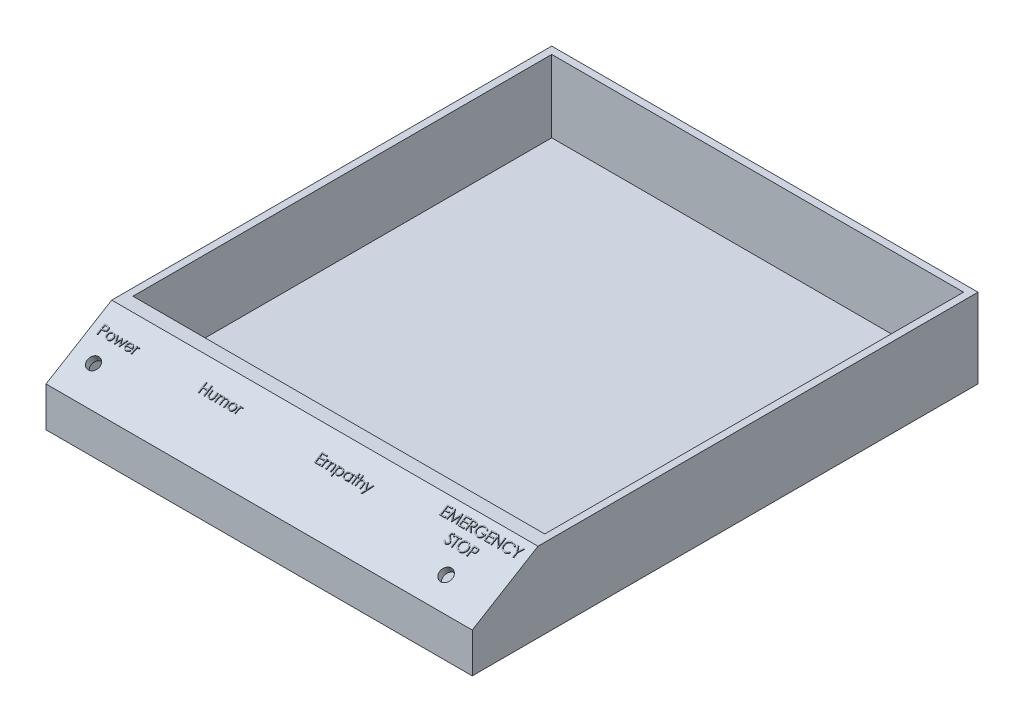
from build123d import *

# Parameters (mm, degrees)
BOSS_EXTRUDE1_DEPTH = 590
SHELL1_T            = -10
BOSS_EXTRUDE3_DEPTH = 1
SKETCH7_R           = 8.5
CUT_EXTRUDE1_DEPTH  = 10
SKETCH8_R           = 8.75
CUT_EXTRUDE2_DEPTH  = 10


with BuildPart() as part:
    # Sketch1 → Boss-Extrude1 (new body)
    with BuildSketch(Plane(origin=(0, 0, 0), x_dir=(0, 0, -1), z_dir=(1, 0, 0))):
        Polygon((-350, 0), (-259.029227557, 55), (350, 55), (350, -55), (-350, -55), align=None)
    extrude(amount=BOSS_EXTRUDE1_DEPTH)

    # Shell1
    shell1_openings = [part.faces().sort_by_distance(p)[0] for p in [
        (295, 55, -45.485386221),
    ]]
    offset(amount=SHELL1_T, openings=shell1_openings, kind=Kind.INTERSECTION)

    # Sketch6 → Boss-Extrude3 (add)
    # profile 1 of 30: a face of its own
    with BuildSketch(Plane(origin=(0, 154.962988648, 93.689040412), x_dir=(1, 0, 0), z_dir=(0, 0.8557552380178882, 0.5173808776954824))):
        with BuildLine():
            Line((11.628205128, -217.613877119), (14.11885016, -217.613877119))
            add(Edge.make_bspline(
                [(14.11885016, -217.613877119), (14.290158305, -217.614065429), (14.618392319, -217.614426237), (15.089072664, -217.625365458), (15.516553691, -217.639976598), (15.899913644, -217.660230896), (16.240332057, -217.684167095), (16.536268544, -217.717738781), (16.79004922, -217.752791853), (16.942109765, -217.788429528), (17.011458333, -217.804682408)],
                knots=[0, 0, 0, 0, 1.415646017, 2.712440637, 3.8905458, 4.950247383, 5.884950622, 6.709939814, 7.411656543, 8, 8, 8, 8], degree=3))
            add(Edge.make_bspline(
                [(17.011458333, -217.804682408), (17.099246299, -217.828710626), (17.272753616, -217.876200867), (17.522765972, -217.971319235), (17.760632783, -218.084103091), (17.987170152, -218.212641387), (18.199594282, -218.362449006), (18.401074488, -218.527453276), (18.589832702, -218.711463825), (18.764807467, -218.912416795), (18.925498019, -219.1269387), (19.063854296, -219.358231934), (19.17970452, -219.602403235), (19.279066676, -219.859282765), (19.350580211, -220.131027653), (19.404453247, -220.415749723), (19.438647553, -220.713418456), (19.441922563, -220.91683569), (19.443589744, -221.020387536)],
                knots=[0, 0, 0, 0, 0.999701418, 1.975846123, 2.934577507, 3.890451536, 4.834027766, 5.787354733, 6.749476667, 7.726910423, 8.712836071, 9.690891519, 10.682875813, 11.679750201, 12.712814741, 13.765529915, 14.8625177, 16, 16, 16, 16], degree=3))
            add(Edge.make_bspline(
                [(19.443589744, -221.020387536), (19.442060574, -221.124809755), (19.43906865, -221.329118878), (19.403159272, -221.628014424), (19.354789719, -221.913649725), (19.280414701, -222.185391445), (19.183003259, -222.441625813), (19.068732095, -222.686268569), (18.930906142, -222.915157664), (18.77253776, -223.129124062), (18.596364832, -223.328368601), (18.403132742, -223.511447427), (18.193621595, -223.677288883), (17.968497229, -223.826264759), (17.725564921, -223.954920402), (17.468509106, -224.070154051), (17.195095464, -224.166931899), (17.005892627, -224.21784098), (16.909695513, -224.243724876)],
                knots=[0, 0, 0, 0, 1.121902311, 2.195077645, 3.232258892, 4.234102512, 5.217864754, 6.176164875, 7.132989551, 8.084763148, 9.034132444, 9.988522005, 10.94243251, 11.903244335, 12.886203696, 13.894208494, 14.929344452, 16, 16, 16, 16], degree=3))
            add(Edge.make_bspline(
                [(16.909695513, -224.243724876), (16.830130615, -224.260644836), (16.655759516, -224.297725912), (16.368584495, -224.339122312), (16.034228381, -224.374455892), (15.653147537, -224.400948591), (15.225684024, -224.423628499), (14.751606605, -224.441655583), (14.229984668, -224.451561053), (13.866143296, -224.452071929), (13.676181891, -224.452338658)],
                knots=[0, 0, 0, 0, 0.601384939, 1.31797006, 2.144135048, 3.087295005, 4.142315834, 5.309527816, 6.595305764, 8, 8, 8, 8], degree=3))
            Line((13.676181891, -224.452338658), (12.767948718, -224.452338658))
            Line((12.767948718, -224.452338658), (12.767948718, -230.313877119))
            Line((12.767948718, -230.313877119), (11.628205128, -230.313877119))
            Line((11.628205128, -230.313877119), (11.628205128, -217.613877119))
        make_face()
        with BuildLine():
            Line((12.767948718, -218.916441222), (12.767948718, -223.149774555))
            Line((12.767948718, -223.149774555), (14.991466346, -223.177759331))
            add(Edge.make_bspline(
                [(14.991466346, -223.177759331), (15.100032934, -223.177815442), (15.309618494, -223.177923762), (15.61237279, -223.163463094), (15.893257918, -223.146769733), (16.151411091, -223.122327953), (16.386948682, -223.087779391), (16.60026343, -223.052902513), (16.789701285, -223.002445912), (17.011404103, -222.934507918), (17.258449392, -222.818638141), (17.527208782, -222.650454254), (17.754976339, -222.436075684), (17.952074158, -222.195037554), (18.108486915, -221.926889284), (18.222990088, -221.639981999), (18.290268001, -221.337258088), (18.299289333, -221.130109699), (18.303846154, -221.025475677)],
                knots=[0, 0, 0, 0, 1.160613943, 2.240541288, 3.23993089, 4.169200891, 5.011653406, 5.7853311, 6.478053781, 7.106038997, 8.262395093, 9.384106736, 10.481365981, 11.59014053, 12.70357646, 13.786202915, 14.881775077, 16, 16, 16, 16], degree=3))
            add(Edge.make_bspline(
                [(18.303846154, -221.025475677), (18.299264551, -220.923373071), (18.290156891, -220.720405727), (18.222462759, -220.422939939), (18.108709535, -220.139056097), (17.951024177, -219.874268045), (17.75964922, -219.634097242), (17.537220175, -219.425464809), (17.284260627, -219.257746059), (17.048954188, -219.149493866), (16.839944171, -219.083398438), (16.65839963, -219.037152874), (16.453419183, -219.00022996), (16.224936097, -218.970332335), (15.9747213, -218.944738348), (15.700625129, -218.927372087), (15.403685909, -218.917206803), (15.197544695, -218.916702594), (15.090685096, -218.916441222)],
                knots=[0, 0, 0, 0, 1.120700087, 2.227813068, 3.331159281, 4.466773991, 5.599788987, 6.693661531, 7.80175334, 8.91857717, 9.525282508, 10.207424825, 10.974604443, 11.810962634, 12.737642355, 13.736264703, 14.826523623, 16, 16, 16, 16], degree=3))
            Line((15.090685096, -218.916441222), (12.767948718, -218.916441222))
        make_face(mode=Mode.SUBTRACT)
    # profile 2 of 30: a face of its own
    with BuildSketch(Plane(origin=(0, 154.962988648, 93.689040412), x_dir=(1, 0, 0), z_dir=(0, 0.8557552380178882, 0.5173808776954824))):
        with BuildLine():
            add(Edge.make_bspline(
                [(26.205729167, -220.870287376), (26.379868928, -220.873995381), (26.721314443, -220.881265872), (27.2213602, -220.958971605), (27.698681122, -221.077797756), (28.155105305, -221.242068852), (28.584787291, -221.462257644), (28.993985806, -221.724999929), (29.381578952, -222.036268197), (29.613891087, -222.277053188), (29.731810897, -222.399273754)],
                knots=[0, 0, 0, 0, 1.054011418, 2.066658804, 3.057071809, 4.030435133, 4.997543892, 5.974964718, 6.972108034, 8, 8, 8, 8], degree=3))
            add(Edge.make_bspline(
                [(29.731810897, -222.399273754), (29.833345416, -222.516164502), (30.034449482, -222.747683841), (30.292316519, -223.123079923), (30.514463323, -223.511845431), (30.692491781, -223.919142873), (30.832863153, -224.34141668), (30.932524393, -224.780118263), (30.991804129, -225.23427878), (30.999797752, -225.542721278), (31.003846154, -225.698933209)],
                knots=[0, 0, 0, 0, 1.025258237, 2.030674902, 3.01204498, 3.988269485, 4.97094183, 5.956517959, 6.965070386, 8, 8, 8, 8], degree=3))
            add(Edge.make_bspline(
                [(31.003846154, -225.698933209), (31.000285301, -225.856050561), (30.993248891, -226.166521776), (30.926687768, -226.623792047), (30.823160685, -227.067184689), (30.674999444, -227.494843378), (30.485014304, -227.908075351), (30.253182381, -228.305075716), (29.977876799, -228.686627742), (29.665805154, -229.049491556), (29.320902632, -229.383923249), (28.946738322, -229.675400113), (28.550665114, -229.92512393), (28.127416375, -230.126278924), (27.680857208, -230.284882694), (27.210024418, -230.396279896), (26.715649449, -230.463632291), (26.378093531, -230.472281257), (26.205729167, -230.476697632)],
                knots=[0, 0, 0, 0, 0.998656419, 1.973391657, 2.932242238, 3.890759089, 4.846373663, 5.82037756, 6.809684879, 7.83454468, 8.860553229, 9.859544525, 10.845671541, 11.83227036, 12.833544569, 13.85385346, 14.904124723, 16, 16, 16, 16], degree=3))
            add(Edge.make_bspline(
                [(26.205729167, -230.476697632), (26.032520327, -230.472266435), (25.693282065, -230.46358771), (25.197162073, -230.39654157), (24.725485456, -230.284934033), (24.278341684, -230.125757702), (23.85327324, -229.925117501), (23.454905094, -229.676155084), (23.080436829, -229.383836807), (22.735461342, -229.049514978), (22.42340926, -228.686621708), (22.14809863, -228.305077282), (21.916268018, -227.908074943), (21.726282535, -227.494843487), (21.578121385, -227.06718466), (21.474594278, -226.623792055), (21.408033162, -226.166521774), (21.40099675, -225.856050561), (21.397435897, -225.698933209)],
                knots=[0, 0, 0, 0, 1.099876186, 2.154163076, 3.173186993, 4.173200201, 5.163417411, 6.152872554, 7.150605724, 8.17532212, 9.198891216, 10.186952605, 11.159729845, 12.11414092, 13.071450619, 14.029093627, 15.002601286, 16, 16, 16, 16], degree=3))
            add(Edge.make_bspline(
                [(21.397435897, -225.698933209), (21.401511909, -225.543570314), (21.409581712, -225.235978482), (21.468801845, -224.78267172), (21.568074322, -224.344712622), (21.70861396, -223.924068752), (21.888283367, -223.51855617), (22.107308612, -223.128830069), (22.36780605, -222.755131479), (22.568110274, -222.52391136), (22.669471154, -222.406905966)],
                knots=[0, 0, 0, 0, 1.031353054, 2.041901799, 3.029428768, 4.008703097, 4.981709435, 5.96992636, 6.972712378, 8, 8, 8, 8], degree=3))
            add(Edge.make_bspline(
                [(22.669471154, -222.406905966), (22.787213184, -222.283625472), (23.018773604, -222.041172688), (23.408296131, -221.730811815), (23.816487996, -221.462602061), (24.250918442, -221.246788365), (24.70696767, -221.076831458), (25.186734635, -220.958665161), (25.68847722, -220.881545844), (26.031593559, -220.874077599), (26.205729167, -220.870287376)],
                knots=[0, 0, 0, 0, 1.027980169, 2.021703884, 2.998553061, 3.971491411, 4.943284454, 5.930300938, 6.949603206, 8, 8, 8, 8], degree=3))
        make_face()
        with BuildLine():
            add(Edge.make_bspline(
                [(26.200641026, -222.010030966), (26.077495979, -222.013531055), (25.834384855, -222.020440881), (25.476536647, -222.072996763), (25.132039517, -222.156263421), (24.800239883, -222.274569568), (24.482256657, -222.42732843), (24.177785397, -222.614955908), (23.885930544, -222.834966922), (23.612401343, -223.087017187), (23.361368381, -223.362349539), (23.141919723, -223.655713584), (22.955320052, -223.962350898), (22.799871475, -224.28258035), (22.684093964, -224.619647109), (22.600008997, -224.96973397), (22.547502695, -225.333554196), (22.540657836, -225.58088132), (22.537179487, -225.706565421)],
                knots=[0, 0, 0, 0, 1.021534396, 2.016698045, 2.994645724, 3.958388632, 4.93408049, 5.916473867, 6.921342795, 7.962252576, 8.998418191, 10.008913653, 10.997312074, 11.973003931, 12.956656626, 13.948281152, 14.957379055, 16, 16, 16, 16], degree=3))
            add(Edge.make_bspline(
                [(22.537179487, -225.706565421), (22.543009962, -225.868951348), (22.554582363, -226.191257048), (22.648690221, -226.66591455), (22.806120436, -227.121597271), (23.018708566, -227.555633871), (23.285068273, -227.957216137), (23.598892772, -228.315252666), (23.956813971, -228.624355468), (24.354565272, -228.880825965), (24.784022368, -229.084605649), (25.238523876, -229.229019076), (25.712562966, -229.32289636), (26.036524476, -229.332227138), (26.200641026, -229.336954042)],
                knots=[0, 0, 0, 0, 1.016792936, 2.018143844, 3.017858371, 4.030088057, 5.03801393, 6.028138512, 7.003788237, 7.991172063, 8.984598303, 9.972568034, 10.972917682, 12, 12, 12, 12], degree=3))
            add(Edge.make_bspline(
                [(26.200641026, -229.336954042), (26.364748136, -229.332199597), (26.688691013, -229.322814454), (27.162071454, -229.229491879), (27.615330724, -229.083972882), (28.044341758, -228.881055149), (28.441912005, -228.623381529), (28.802407388, -228.316998104), (29.113552349, -227.956267843), (29.379648572, -227.555101953), (29.595718181, -227.122270161), (29.752411514, -226.665830447), (29.846745611, -226.191278467), (29.858287475, -225.868958524), (29.864102564, -225.706565421)],
                knots=[0, 0, 0, 0, 1.02726834, 2.027799167, 3.010890988, 4.004497153, 4.992059811, 5.971914811, 6.958719428, 7.966827853, 8.981595046, 9.981490638, 10.983022906, 12, 12, 12, 12], degree=3))
            add(Edge.make_bspline(
                [(29.864102564, -225.706565421), (29.860625413, -225.580880568), (29.85378291, -225.333551967), (29.801259468, -224.969742492), (29.717237938, -224.619615842), (29.601226641, -224.282695715), (29.446453505, -223.961521771), (29.256255428, -223.656613904), (29.03770285, -223.361333294), (28.783640725, -223.087907226), (28.51039704, -222.834868665), (28.218423901, -222.614870595), (27.914404122, -222.428153034), (27.597344693, -222.273262961), (27.265502519, -222.157339755), (26.921488079, -222.072515978), (26.565166683, -222.020662979), (26.322926727, -222.013597637), (26.200641026, -222.010030966)],
                knots=[0, 0, 0, 0, 1.042956736, 2.052379634, 3.044323526, 4.02829302, 5.004299113, 5.996692471, 7.007513377, 8.048758398, 9.090003419, 10.095195979, 11.07790575, 12.047570684, 13.018257071, 13.989683339, 14.985167495, 16, 16, 16, 16], degree=3))
        make_face(mode=Mode.SUBTRACT)
    # profile 3 of 30: a face of its own
    with BuildSketch(Plane(origin=(0, 154.962988648, 93.689040412), x_dir=(1, 0, 0), z_dir=(0, 0.8557552380178882, 0.5173808776954824))):
        Polygon((31.980769231, -221.033107889), (33.204467147, -221.033107889), (35.969871795, -227.708748914), (38.999859776, -221.033107889), (39.193209135, -221.033107889), (42.157051282, -227.708748914), (44.947896635, -221.033107889), (46.146153846, -221.033107889), (42.266446314, -230.313877119), (42.029847756, -230.313877119), (39.063461538, -223.638236094), (36.036017628, -230.313877119), (35.824859776, -230.313877119), align=None)
    # profile 4 of 30: a face of its own
    with BuildSketch(Plane(origin=(0, 154.962988648, 93.689040412), x_dir=(1, 0, 0), z_dir=(0, 0.8557552380178882, 0.5173808776954824))):
        with BuildLine():
            Line((55.228485577, -227.383107889), (56.241025641, -227.914818626))
            add(Edge.make_bspline(
                [(56.241025641, -227.914818626), (56.160338567, -228.057941571), (56.003353473, -228.336402144), (55.733385045, -228.71896918), (55.450385239, -229.063130892), (55.141579412, -229.359692781), (54.816206577, -229.61823352), (54.472462373, -229.84443077), (54.108557234, -230.037175115), (53.724473947, -230.199562859), (53.316987004, -230.324420166), (52.88510893, -230.412609768), (52.428012361, -230.467122771), (52.11469908, -230.473455139), (51.954266827, -230.476697632)],
                knots=[0, 0, 0, 0, 1.120438281, 2.179929193, 3.190490725, 4.156257408, 5.095198341, 6.022838206, 6.959905092, 7.901321166, 8.864066838, 9.862729781, 10.905609505, 12, 12, 12, 12], degree=3))
            add(Edge.make_bspline(
                [(51.954266827, -230.476697632), (51.775951651, -230.472535025), (51.428110402, -230.464414983), (50.921780462, -230.394410898), (50.445060858, -230.280211196), (49.997978392, -230.120679089), (49.581627933, -229.912299941), (49.195181974, -229.658446964), (48.836608266, -229.360424212), (48.517206135, -229.01565026), (48.229664046, -228.646690014), (47.975933214, -228.262221519), (47.76381625, -227.863212105), (47.591268207, -227.452201918), (47.451913411, -227.031781504), (47.354788515, -226.598125607), (47.298800572, -226.152407916), (47.290221013, -225.850883298), (47.285897436, -225.698933209)],
                knots=[0, 0, 0, 0, 1.145258523, 2.234067595, 3.276747158, 4.290159414, 5.277019952, 6.260822364, 7.254936242, 8.264827045, 9.274100331, 10.257902744, 11.220704747, 12.172965371, 13.118907548, 14.062713208, 15.023725156, 16, 16, 16, 16], degree=3))
            add(Edge.make_bspline(
                [(47.285897436, -225.698933209), (47.289740606, -225.55634911), (47.297357261, -225.273766255), (47.345366118, -224.855516994), (47.430449925, -224.449013752), (47.547204014, -224.053918755), (47.697975679, -223.670893526), (47.882424017, -223.299704952), (48.10083636, -222.940748016), (48.269465776, -222.714313788), (48.354407051, -222.600255325)],
                knots=[0, 0, 0, 0, 1.024358464, 2.0301432, 3.019427413, 4.004406732, 4.986367066, 5.972626655, 6.978780325, 8, 8, 8, 8], degree=3))
            add(Edge.make_bspline(
                [(48.354407051, -222.600255325), (48.469460643, -222.462845424), (48.695923221, -222.192378421), (49.078941996, -221.837002211), (49.493688423, -221.539300512), (49.934964894, -221.292531761), (50.4079001, -221.105030242), (50.906136671, -220.965302729), (51.435347798, -220.887005375), (51.797135313, -220.875946093), (51.982251603, -220.870287376)],
                knots=[0, 0, 0, 0, 1.030682036, 2.02871468, 2.997146059, 3.962720338, 4.930598197, 5.918074684, 6.934738563, 8, 8, 8, 8], degree=3))
            add(Edge.make_bspline(
                [(51.982251603, -220.870287376), (52.172561485, -220.875200639), (52.545906091, -220.884839341), (53.090308359, -220.974197751), (53.605422959, -221.115902735), (54.09104376, -221.316032203), (54.547219998, -221.57423972), (54.970986521, -221.894068687), (55.369590581, -222.265700032), (55.601487424, -222.551497964), (55.719491186, -222.696930004)],
                knots=[0, 0, 0, 0, 1.056321875, 2.072262726, 3.055038591, 4.01806755, 4.982017516, 5.957941055, 6.960871419, 8, 8, 8, 8], degree=3))
            add(Edge.make_bspline(
                [(55.719491186, -222.696930004), (55.799780362, -222.806525856), (55.959824286, -223.024988059), (56.160292334, -223.381209114), (56.334309168, -223.753901842), (56.473403055, -224.149090635), (56.586032102, -224.562093111), (56.667518273, -224.995861774), (56.715305174, -225.450267452), (56.724698448, -225.759880953), (56.729487179, -225.917723273)],
                knots=[0, 0, 0, 0, 0.94817472, 1.890038105, 2.849395472, 3.817997239, 4.812318967, 5.836947057, 6.897266129, 8, 8, 8, 8], degree=3))
            Line((56.729487179, -225.917723273), (48.425641026, -225.917723273))
            add(Edge.make_bspline(
                [(48.425641026, -225.917723273), (48.431227598, -226.040007815), (48.442213366, -226.280475434), (48.493431171, -226.632340847), (48.574162436, -226.967524117), (48.687624463, -227.283511155), (48.825027016, -227.584429047), (48.993340903, -227.868045581), (49.194144427, -228.133068927), (49.418120536, -228.381869683), (49.667429139, -228.603433017), (49.929712251, -228.80174089), (50.208726044, -228.96794977), (50.502270518, -229.102859656), (50.809870995, -229.208474003), (51.131624389, -229.280565809), (51.466897554, -229.328851597), (51.695445789, -229.334220668), (51.811798878, -229.336954042)],
                knots=[0, 0, 0, 0, 1.094153842, 2.151609401, 3.174256925, 4.172055639, 5.149267565, 6.128595816, 7.11444997, 8.118368179, 9.117203808, 10.09244225, 11.054858984, 12.015122123, 12.976791628, 13.957293641, 14.960065497, 16, 16, 16, 16], degree=3))
            add(Edge.make_bspline(
                [(51.811798878, -229.336954042), (51.925558757, -229.334747665), (52.151280178, -229.33036979), (52.487434146, -229.287799713), (52.818140431, -229.218964713), (53.142030285, -229.125021035), (53.452530211, -229.010442172), (53.74007835, -228.872183231), (54.004529418, -228.719239864), (54.251696697, -228.544307615), (54.491440016, -228.330192193), (54.729265609, -228.06299972), (54.984269466, -227.746996405), (55.143888845, -227.509159274), (55.228485577, -227.383107889)],
                knots=[0, 0, 0, 0, 0.99110716, 1.966546729, 2.947904876, 3.932708344, 4.903319531, 5.828989031, 6.710028674, 7.56322171, 8.463672341, 9.504779593, 10.677557249, 12, 12, 12, 12], degree=3))
        make_face()
        with BuildLine():
            add(Edge.make_bspline(
                [(55.58974359, -224.777979684), (55.548027266, -224.62680297), (55.467736772, -224.335836461), (55.299964821, -223.932916659), (55.111019517, -223.574820561), (54.887420663, -223.26428875), (54.63407843, -222.988504574), (54.341451624, -222.747499993), (54.013298525, -222.531899528), (53.651315357, -222.349917601), (53.267986594, -222.1950144), (52.866644126, -222.091146123), (52.457131582, -222.019991498), (52.180147171, -222.013365333), (52.040765224, -222.010030966)],
                knots=[0, 0, 0, 0, 1.154881502, 2.222775134, 3.210006277, 4.132804581, 5.035138423, 5.962687519, 6.919655026, 7.923214229, 8.944639381, 9.960483929, 10.97369054, 12, 12, 12, 12], degree=3))
            add(Edge.make_bspline(
                [(52.040765224, -222.010030966), (51.927011547, -222.012250459), (51.702144444, -222.016637932), (51.370851996, -222.058258116), (51.052699946, -222.127055267), (50.745340759, -222.221270967), (50.45280218, -222.346850753), (50.169066878, -222.49410989), (49.90134944, -222.673875065), (49.733922454, -222.810885767), (49.649338942, -222.880103081)],
                knots=[0, 0, 0, 0, 1.04873581, 2.073130211, 3.073294108, 4.04793562, 5.032784715, 6.005352987, 6.992311501, 8, 8, 8, 8], degree=3))
            add(Edge.make_bspline(
                [(49.649338942, -222.880103081), (49.588766176, -222.934873883), (49.466181661, -223.045716639), (49.302386054, -223.236685474), (49.145557482, -223.442612571), (49.002832513, -223.671376309), (48.871922414, -223.920371707), (48.749421925, -224.187498555), (48.639162659, -224.474783913), (48.577128202, -224.67498105), (48.54521234, -224.777979684)],
                knots=[0, 0, 0, 0, 0.879870761, 1.780643979, 2.707998968, 3.669668524, 4.684282772, 5.740141944, 6.837334558, 8, 8, 8, 8], degree=3))
            Line((48.54521234, -224.777979684), (55.58974359, -224.777979684))
        make_face(mode=Mode.SUBTRACT)
    # profile 5 of 30: a face of its own
    with BuildSketch(Plane(origin=(0, 154.962988648, 93.689040412), x_dir=(1, 0, 0), z_dir=(0, 0.8557552380178882, 0.5173808776954824))):
        with BuildLine():
            Line((58.683333333, -221.033107889), (59.823076923, -221.033107889))
            Line((59.823076923, -221.033107889), (59.823076923, -222.399273754))
            add(Edge.make_bspline(
                [(59.823076923, -222.399273754), (59.907218991, -222.272071177), (60.068140041, -222.028797237), (60.33561267, -221.707054344), (60.609581901, -221.440662604), (60.891359295, -221.228378407), (61.183016972, -221.069399376), (61.478153911, -220.952947506), (61.781413473, -220.884086962), (61.985201026, -220.8748934), (62.087299679, -220.870287376)],
                knots=[0, 0, 0, 0, 1.2804753, 2.448899062, 3.506932113, 4.484331642, 5.4025378, 6.288909075, 7.142734305, 8, 8, 8, 8], degree=3))
            add(Edge.make_bspline(
                [(62.087299679, -220.870287376), (62.166498064, -220.874607287), (62.329453888, -220.883495784), (62.576133571, -220.94594649), (62.830291239, -221.045652458), (62.994093616, -221.139415552), (63.079487179, -221.18829619)],
                knots=[0, 0, 0, 0, 0.901110191, 1.854092781, 2.881294221, 4, 4, 4, 4], degree=3))
            Line((63.079487179, -221.18829619), (62.453645833, -222.175395549))
            add(Edge.make_bspline(
                [(62.453645833, -222.175395549), (62.398821671, -222.150938012), (62.294754915, -222.104512925), (62.142519775, -222.049569059), (62.002161782, -222.017217022), (61.91274087, -222.012315847), (61.871053686, -222.010030966)],
                knots=[0, 0, 0, 0, 1.180555205, 2.24091978, 3.179933427, 4, 4, 4, 4], degree=3))
            add(Edge.make_bspline(
                [(61.871053686, -222.010030966), (61.779592881, -222.016127101), (61.593039352, -222.028561451), (61.319138454, -222.126310839), (61.053355737, -222.284245282), (60.842275705, -222.459400459), (60.678836673, -222.628302467), (60.562213569, -222.775798099), (60.455233316, -222.941183419), (60.353015659, -223.121631129), (60.259883677, -223.320222284), (60.172962449, -223.534972802), (60.094371718, -223.766131412), (60.049557975, -223.927176557), (60.026602564, -224.009670389)],
                knots=[0, 0, 0, 0, 1.125678352, 2.296057538, 3.5422874, 4.923748041, 5.663163013, 6.437101912, 7.23742474, 8.08941207, 8.991984279, 9.93940061, 10.944477711, 12, 12, 12, 12], degree=3))
            add(Edge.make_bspline(
                [(60.026602564, -224.009670389), (60.009430737, -224.083247561), (59.971396444, -224.246215408), (59.934415721, -224.519622912), (59.897877756, -224.842651616), (59.872127169, -225.216200682), (59.848258273, -225.639337264), (59.834795975, -226.112705981), (59.823536008, -226.636792713), (59.823234594, -227.003185366), (59.823076923, -227.194846671)],
                knots=[0, 0, 0, 0, 0.566838948, 1.255505196, 2.06880316, 3.007127437, 4.065329342, 5.249902469, 6.561414163, 8, 8, 8, 8], degree=3))
            Line((59.823076923, -227.194846671), (59.823076923, -230.313877119))
            Line((59.823076923, -230.313877119), (58.683333333, -230.313877119))
            Line((58.683333333, -230.313877119), (58.683333333, -221.033107889))
        make_face()
    # profile 6 of 30: a face of its own
    with BuildSketch(Plane(origin=(0, 154.962988648, 93.689040412), x_dir=(1, 0, 0), z_dir=(0, 0.8557552380178882, 0.5173808776954824))):
        Polygon((151.702085579, -217.613877119), (152.841829169, -217.613877119), (152.841829169, -222.82413353), (159.354649682, -222.82413353), (159.354649682, -217.613877119), (160.494393272, -217.613877119), (160.494393272, -230.313877119), (159.354649682, -230.313877119), (159.354649682, -224.126697632), (152.841829169, -224.126697632), (152.841829169, -230.313877119), (151.702085579, -230.313877119), align=None)
    # profile 7 of 30: a face of its own
    with BuildSketch(Plane(origin=(0, 154.962988648, 93.689040412), x_dir=(1, 0, 0), z_dir=(0, 0.8557552380178882, 0.5173808776954824))):
        with BuildLine():
            Line((163.26234199, -221.033107889), (164.402085579, -221.033107889))
            Line((164.402085579, -221.033107889), (164.402085579, -225.337675196))
            add(Edge.make_bspline(
                [(164.402085579, -225.337675196), (164.402600491, -225.464032029), (164.403585494, -225.705746731), (164.41026548, -226.053564123), (164.425977534, -226.370761909), (164.445621983, -226.657523325), (164.470884591, -226.913799861), (164.500941356, -227.138696385), (164.5345362, -227.334763281), (164.567420905, -227.452849172), (164.582714586, -227.507767344)],
                knots=[0, 0, 0, 0, 1.388932606, 2.656963016, 3.823490214, 4.879454478, 5.816252168, 6.653371382, 7.373723809, 8, 8, 8, 8], degree=3))
            add(Edge.make_bspline(
                [(164.582714586, -227.507767344), (164.607249008, -227.57679319), (164.655807788, -227.713409852), (164.743885858, -227.910764242), (164.852845822, -228.093554552), (164.972080055, -228.26882933), (165.109600762, -228.43139654), (165.263667986, -228.580981653), (165.429124446, -228.723236498), (165.674978388, -228.891547029), (166.011199153, -229.071942655), (166.452624865, -229.227593196), (166.931248771, -229.320614601), (167.262046467, -229.331406897), (167.43207356, -229.336954042)],
                knots=[0, 0, 0, 0, 0.725840625, 1.436591201, 2.137033971, 2.831655856, 3.53531722, 4.242432219, 4.957935707, 5.694543706, 7.190802206, 8.724350549, 10.316345118, 12, 12, 12, 12], degree=3))
            add(Edge.make_bspline(
                [(167.43207356, -229.336954042), (167.602084859, -229.33128894), (167.931025267, -229.320328016), (168.404390442, -229.230399176), (168.837102717, -229.080155676), (169.224819026, -228.870397353), (169.565780789, -228.613704725), (169.849913965, -228.312501334), (170.084346003, -227.976316415), (170.186705901, -227.725494032), (170.238183336, -227.599353882)],
                knots=[0, 0, 0, 0, 1.157059328, 2.238695713, 3.266970494, 4.264342957, 5.228770407, 6.160125903, 7.074715775, 8, 8, 8, 8], degree=3))
            add(Edge.make_bspline(
                [(170.238183336, -227.599353882), (170.253402399, -227.54867617), (170.287048031, -227.436640125), (170.323197135, -227.246576466), (170.35576161, -227.019919187), (170.383567992, -226.755185116), (170.403398725, -226.453066077), (170.414088593, -226.113656486), (170.426165478, -225.738021836), (170.426348779, -225.475067395), (170.426444554, -225.337675196)],
                knots=[0, 0, 0, 0, 0.557542046, 1.232589297, 2.036731608, 2.971723315, 4.038036528, 5.22795436, 6.551621927, 8, 8, 8, 8], degree=3))
            Line((170.426444554, -225.337675196), (170.426444554, -221.033107889))
            Line((170.426444554, -221.033107889), (171.566188143, -221.033107889))
            Line((171.566188143, -221.033107889), (171.566188143, -225.551377119))
            add(Edge.make_bspline(
                [(171.566188143, -225.551377119), (171.564585422, -225.704891713), (171.561475924, -226.002731024), (171.541492135, -226.435561943), (171.50720354, -226.838922089), (171.455160083, -227.213024972), (171.393961778, -227.557584977), (171.315017588, -227.87304371), (171.220753696, -228.158429234), (171.114416542, -228.418749396), (170.988788623, -228.654776698), (170.855159148, -228.878789518), (170.700854976, -229.085229597), (170.538402983, -229.284373352), (170.357694118, -229.466315466), (170.16211463, -229.635230821), (169.954417306, -229.793701536), (169.729993073, -229.935547036), (169.492118216, -230.063333149), (169.240499078, -230.176602918), (168.972053742, -230.266237983), (168.690245688, -230.343565256), (168.393694231, -230.404214901), (168.082685263, -230.446983301), (167.757323541, -230.47320093), (167.535583501, -230.475512493), (167.421897278, -230.476697632)],
                knots=[0, 0, 0, 0, 1.493040784, 2.896703357, 4.213163133, 5.428574705, 6.569057535, 7.615249723, 8.588095153, 9.490268104, 10.346124644, 11.18633936, 12.024365274, 12.850166724, 13.684164916, 14.514361689, 15.362232829, 16.222528818, 17.093394965, 17.986930858, 18.902426812, 19.842810585, 20.827885679, 21.843828298, 22.894529745, 24, 24, 24, 24], degree=3))
            add(Edge.make_bspline(
                [(167.421897278, -230.476697632), (167.309061355, -230.475464981), (167.087328263, -230.473042705), (166.761949748, -230.447128146), (166.450079091, -230.404281355), (166.152825074, -230.343120995), (165.869889404, -230.266779227), (165.600126019, -230.176052113), (165.346693662, -230.063274365), (165.106547533, -229.936355799), (164.881567438, -229.792790371), (164.670716312, -229.635426341), (164.474276876, -229.464498627), (164.292205801, -229.280721074), (164.127058714, -229.081813905), (163.976777649, -228.869377157), (163.839049033, -228.64551575), (163.714397479, -228.405800846), (163.607311966, -228.142468125), (163.512768645, -227.851104373), (163.435441472, -227.528515241), (163.372513087, -227.174976529), (163.321889288, -226.792180235), (163.286742429, -226.377911985), (163.2670907, -225.933180874), (163.26395902, -225.626022701), (163.26234199, -225.467422792)],
                knots=[0, 0, 0, 0, 1.083640291, 2.129454052, 3.13281866, 4.105697902, 5.042300162, 5.946461698, 6.836384745, 7.703652036, 8.553297018, 9.397182691, 10.228592656, 11.052265423, 11.879314572, 12.708807002, 13.549817954, 14.402308542, 15.300838682, 16.27712199, 17.341985831, 18.484375296, 19.725102775, 21.0496083, 22.476576903, 24, 24, 24, 24], degree=3))
            Line((163.26234199, -225.467422792), (163.26234199, -221.033107889))
        make_face()
    # profile 8 of 30: a face of its own
    with BuildSketch(Plane(origin=(0, 154.962988648, 93.689040412), x_dir=(1, 0, 0), z_dir=(0, 0.8557552380178882, 0.5173808776954824))):
        with BuildLine():
            Line((174.171316349, -221.033107889), (175.311059938, -221.033107889))
            Line((175.311059938, -221.033107889), (175.311059938, -222.646048594))
            add(Edge.make_bspline(
                [(175.311059938, -222.646048594), (175.413690271, -222.504942153), (175.610339827, -222.234568685), (175.932795195, -221.878278225), (176.25492566, -221.575916064), (176.486912502, -221.41719193), (176.598359618, -221.340940421)],
                knots=[0, 0, 0, 0, 1.134379233, 2.173579362, 3.122582517, 4, 4, 4, 4], degree=3))
            add(Edge.make_bspline(
                [(176.598359618, -221.340940421), (176.750268535, -221.268349524), (177.051432342, -221.124435978), (177.528296387, -220.978445636), (178.016247331, -220.88872884), (178.345751421, -220.876459285), (178.511500643, -220.870287376)],
                knots=[0, 0, 0, 0, 1.014936303, 2.012140481, 3.000054389, 4, 4, 4, 4], degree=3))
            add(Edge.make_bspline(
                [(178.511500643, -220.870287376), (178.623598088, -220.874080288), (178.845432903, -220.881586257), (179.174123745, -220.930426957), (179.492924993, -221.014849927), (179.799953043, -221.132442217), (180.089225222, -221.274851624), (180.354434596, -221.441946278), (180.592556723, -221.629532809), (180.803471252, -221.84608208), (180.993133144, -222.097674881), (181.167590674, -222.391096584), (181.32879073, -222.732935811), (181.418130908, -222.981008688), (181.465166509, -223.111613498)],
                knots=[0, 0, 0, 0, 1.009824226, 1.998387844, 2.986035974, 3.974953746, 4.955485308, 5.885931332, 6.793869504, 7.679848016, 8.601185859, 9.625726857, 10.749998409, 12, 12, 12, 12], degree=3))
            add(Edge.make_bspline(
                [(181.465166509, -223.111613498), (181.514918764, -223.021899176), (181.612824214, -222.845353991), (181.777218955, -222.595496868), (181.949459245, -222.361792223), (182.131012977, -222.144054626), (182.321239335, -221.943359319), (182.521033559, -221.759042761), (182.729258337, -221.590313414), (183.018790179, -221.39319795), (183.39548164, -221.183825092), (183.870418513, -221.002293309), (184.364449136, -220.890111929), (184.699793355, -220.876939225), (184.869132855, -220.870287376)],
                knots=[0, 0, 0, 0, 0.86119277, 1.694706429, 2.50939023, 3.298075842, 4.073795165, 4.829715201, 5.57930267, 6.321991688, 7.768977793, 9.186738141, 10.579381044, 12, 12, 12, 12], degree=3))
            add(Edge.make_bspline(
                [(184.869132855, -220.870287376), (185.024731306, -220.876155577), (185.329252582, -220.887640217), (185.772581517, -220.97782282), (186.186027496, -221.132681711), (186.568758601, -221.343986621), (186.914052781, -221.609522515), (187.214194818, -221.925458011), (187.467361564, -222.289558386), (187.632746914, -222.63206646), (187.744925159, -222.934454667), (187.814090209, -223.192106067), (187.875194245, -223.475684559), (187.925926193, -223.785529222), (187.963004939, -224.122734573), (187.990475821, -224.486748779), (188.009068888, -224.877854756), (188.010382693, -225.147695285), (188.011059938, -225.286793786)],
                knots=[0, 0, 0, 0, 1.209669288, 2.367440248, 3.500751976, 4.631527125, 5.755587489, 6.87532382, 8.007944318, 9.190864318, 9.82315674, 10.514484317, 11.263564316, 12.079023757, 12.955305781, 13.901327259, 14.918167583, 16, 16, 16, 16], degree=3))
            Line((188.011059938, -225.286793786), (188.011059938, -230.313877119))
            Line((188.011059938, -230.313877119), (186.871316349, -230.313877119))
            Line((186.871316349, -230.313877119), (186.871316349, -225.281705645))
            add(Edge.make_bspline(
                [(186.871316349, -225.281705645), (186.871033745, -225.162976705), (186.870490623, -224.93479774), (186.860716588, -224.607310274), (186.842300449, -224.308793664), (186.820766188, -224.039654944), (186.790852937, -223.799266483), (186.752223413, -223.588111135), (186.711301546, -223.404527877), (186.643316664, -223.201015647), (186.5346486, -222.976515169), (186.369122315, -222.734403908), (186.16058793, -222.523653576), (185.919795362, -222.340707112), (185.645662434, -222.191958757), (185.343530438, -222.085728665), (185.015275165, -222.019968506), (184.788043905, -222.01341525), (184.670695355, -222.010030966)],
                knots=[0, 0, 0, 0, 1.253487763, 2.409012846, 3.458416907, 4.410876679, 5.259312806, 6.014470957, 6.676830364, 7.243083969, 8.276244668, 9.299465089, 10.325150304, 11.392391894, 12.482080715, 13.603491619, 14.762376348, 16, 16, 16, 16], degree=3))
            add(Edge.make_bspline(
                [(184.670695355, -222.010030966), (184.526750092, -222.015169594), (184.242259528, -222.025325477), (183.826985907, -222.129007816), (183.427948218, -222.285327582), (183.057053307, -222.511868213), (182.715866753, -222.783315704), (182.422316856, -223.106075666), (182.179811497, -223.471218544), (182.015604213, -223.809208006), (181.911865891, -224.11280856), (181.843369654, -224.378047595), (181.790089919, -224.679514999), (181.74012257, -225.015185037), (181.707509957, -225.387368263), (181.677870435, -225.794343032), (181.664006161, -226.237333399), (181.66206684, -226.544407384), (181.661059938, -226.703841062)],
                knots=[0, 0, 0, 0, 1.090531906, 2.155305635, 3.229839962, 4.33261226, 5.44038871, 6.529323825, 7.629011124, 8.757537029, 9.370236727, 10.061839251, 10.834451254, 11.692844982, 12.636905849, 13.66920014, 14.789842145, 16, 16, 16, 16], degree=3))
            Line((181.661059938, -226.703841062), (181.661059938, -230.313877119))
            Line((181.661059938, -230.313877119), (180.521316349, -230.313877119))
            Line((180.521316349, -230.313877119), (180.521316349, -225.594626318))
            add(Edge.make_bspline(
                [(180.521316349, -225.594626318), (180.521028128, -225.46148199), (180.520473619, -225.205325685), (180.510762411, -224.837992064), (180.492305241, -224.503869287), (180.470967251, -224.20334569), (180.440268889, -223.93696744), (180.405399181, -223.703306461), (180.364219937, -223.502948535), (180.296039498, -223.283189967), (180.191846999, -223.041088333), (180.024249591, -222.782948056), (179.815216371, -222.557003816), (179.570030621, -222.3641135), (179.294238575, -222.204668697), (178.989498806, -222.089789026), (178.658555265, -222.022935175), (178.430399018, -222.014413487), (178.313063143, -222.010030966)],
                knots=[0, 0, 0, 0, 1.320475261, 2.540461679, 3.643808994, 4.639130445, 5.527981419, 6.302341397, 6.981980563, 7.553956391, 8.582137848, 9.585246428, 10.591171744, 11.620968678, 12.668337649, 13.738356861, 14.836885341, 16, 16, 16, 16], degree=3))
            add(Edge.make_bspline(
                [(178.313063143, -222.010030966), (178.175118605, -222.015584349), (177.900200038, -222.026652045), (177.496332891, -222.126271839), (177.10631341, -222.282315196), (176.736363503, -222.498795111), (176.396460165, -222.766943196), (176.098887309, -223.082320103), (175.848724431, -223.441000882), (175.682783274, -223.775426414), (175.575745954, -224.071420868), (175.504642882, -224.323065735), (175.443539097, -224.602466636), (175.398131075, -224.910485582), (175.354296424, -225.24511641), (175.333140732, -225.608026129), (175.312561063, -225.998903419), (175.311572587, -226.268769512), (175.311059938, -226.408728882)],
                knots=[0, 0, 0, 0, 1.098833095, 2.189935336, 3.297829714, 4.440610912, 5.596351641, 6.740013378, 7.886572111, 9.072425424, 9.705826452, 10.395263256, 11.156850408, 11.985370555, 12.878090359, 13.847760091, 14.883794034, 16, 16, 16, 16], degree=3))
            Line((175.311059938, -226.408728882), (175.311059938, -230.313877119))
            Line((175.311059938, -230.313877119), (174.171316349, -230.313877119))
            Line((174.171316349, -230.313877119), (174.171316349, -221.033107889))
        make_face()
    # profile 9 of 30: a face of its own
    with BuildSketch(Plane(origin=(0, 154.962988648, 93.689040412), x_dir=(1, 0, 0), z_dir=(0, 0.8557552380178882, 0.5173808776954824))):
        with BuildLine():
            add(Edge.make_bspline(
                [(195.098840387, -220.870287376), (195.272980148, -220.873995381), (195.614425663, -220.881265872), (196.11447142, -220.958971605), (196.591792342, -221.077797756), (197.048216525, -221.242068852), (197.477898512, -221.462257644), (197.887097026, -221.724999929), (198.274690172, -222.036268197), (198.507002307, -222.277053188), (198.624922118, -222.399273754)],
                knots=[0, 0, 0, 0, 1.054011418, 2.066658804, 3.057071809, 4.030435133, 4.997543892, 5.974964718, 6.972108034, 8, 8, 8, 8], degree=3))
            add(Edge.make_bspline(
                [(198.624922118, -222.399273754), (198.726456637, -222.516164502), (198.927560702, -222.747683841), (199.185427739, -223.123079923), (199.407574543, -223.511845431), (199.585603001, -223.919142873), (199.725974373, -224.34141668), (199.825635614, -224.780118263), (199.884915349, -225.23427878), (199.892908972, -225.542721278), (199.896957374, -225.698933209)],
                knots=[0, 0, 0, 0, 1.025258237, 2.030674902, 3.01204498, 3.988269485, 4.97094183, 5.956517959, 6.965070386, 8, 8, 8, 8], degree=3))
            add(Edge.make_bspline(
                [(199.896957374, -225.698933209), (199.893396522, -225.856050561), (199.886360111, -226.166521776), (199.819798989, -226.623792047), (199.716271906, -227.067184689), (199.568110664, -227.494843378), (199.378125525, -227.908075351), (199.146293601, -228.305075716), (198.870988019, -228.686627742), (198.558916374, -229.049491556), (198.214013852, -229.383923249), (197.839849542, -229.675400113), (197.443776334, -229.92512393), (197.020527595, -230.126278924), (196.573968428, -230.284882694), (196.103135638, -230.396279896), (195.608760669, -230.463632291), (195.271204752, -230.472281257), (195.098840387, -230.476697632)],
                knots=[0, 0, 0, 0, 0.998656419, 1.973391657, 2.932242238, 3.890759089, 4.846373663, 5.82037756, 6.809684879, 7.83454468, 8.860553229, 9.859544525, 10.845671541, 11.83227036, 12.833544569, 13.85385346, 14.904124723, 16, 16, 16, 16], degree=3))
            add(Edge.make_bspline(
                [(195.098840387, -230.476697632), (194.925631548, -230.472266435), (194.586393285, -230.46358771), (194.090273294, -230.39654157), (193.618596676, -230.284934033), (193.171452905, -230.125757702), (192.74638446, -229.925117501), (192.348016314, -229.676155084), (191.973548049, -229.383836807), (191.628572563, -229.049514978), (191.31652048, -228.686621708), (191.04120985, -228.305077282), (190.809379238, -227.908074943), (190.619393755, -227.494843487), (190.471232606, -227.06718466), (190.367705498, -226.623792055), (190.301144382, -226.166521774), (190.294107971, -225.856050561), (190.290547118, -225.698933209)],
                knots=[0, 0, 0, 0, 1.099876186, 2.154163076, 3.173186993, 4.173200201, 5.163417411, 6.152872554, 7.150605724, 8.17532212, 9.198891216, 10.186952605, 11.159729845, 12.11414092, 13.071450619, 14.029093627, 15.002601286, 16, 16, 16, 16], degree=3))
            add(Edge.make_bspline(
                [(190.290547118, -225.698933209), (190.29462313, -225.543570314), (190.302692933, -225.235978482), (190.361913065, -224.78267172), (190.461185542, -224.344712622), (190.60172518, -223.924068752), (190.781394587, -223.51855617), (191.000419832, -223.128830069), (191.26091727, -222.755131479), (191.461221494, -222.52391136), (191.562582374, -222.406905966)],
                knots=[0, 0, 0, 0, 1.031353054, 2.041901799, 3.029428768, 4.008703097, 4.981709435, 5.96992636, 6.972712378, 8, 8, 8, 8], degree=3))
            add(Edge.make_bspline(
                [(191.562582374, -222.406905966), (191.680324404, -222.283625472), (191.911884825, -222.041172688), (192.301407351, -221.730811815), (192.709599216, -221.462602061), (193.144029662, -221.246788365), (193.60007889, -221.076831458), (194.079845856, -220.958665161), (194.58158844, -220.881545844), (194.92470478, -220.874077599), (195.098840387, -220.870287376)],
                knots=[0, 0, 0, 0, 1.027980169, 2.021703884, 2.998553061, 3.971491411, 4.943284454, 5.930300938, 6.949603206, 8, 8, 8, 8], degree=3))
        make_face()
        with BuildLine():
            add(Edge.make_bspline(
                [(195.093752246, -222.010030966), (194.970607199, -222.013531055), (194.727496075, -222.020440881), (194.369647868, -222.072996763), (194.025150738, -222.156263421), (193.693351103, -222.274569568), (193.375367878, -222.42732843), (193.070896618, -222.614955908), (192.779041764, -222.834966922), (192.505512563, -223.087017187), (192.254479602, -223.362349539), (192.035030944, -223.655713584), (191.848431272, -223.962350898), (191.692982695, -224.28258035), (191.577205184, -224.619647109), (191.493120217, -224.96973397), (191.440613916, -225.333554196), (191.433769056, -225.58088132), (191.430290707, -225.706565421)],
                knots=[0, 0, 0, 0, 1.021534396, 2.016698045, 2.994645724, 3.958388632, 4.93408049, 5.916473867, 6.921342795, 7.962252576, 8.998418191, 10.008913653, 10.997312074, 11.973003931, 12.956656626, 13.948281152, 14.957379055, 16, 16, 16, 16], degree=3))
            add(Edge.make_bspline(
                [(191.430290707, -225.706565421), (191.436121182, -225.868951348), (191.447693583, -226.191257048), (191.541801441, -226.66591455), (191.699231657, -227.121597271), (191.911819786, -227.555633871), (192.178179494, -227.957216137), (192.492003993, -228.315252666), (192.849925191, -228.624355468), (193.247676492, -228.880825965), (193.677133588, -229.084605649), (194.131635096, -229.229019076), (194.605674186, -229.32289636), (194.929635696, -229.332227138), (195.093752246, -229.336954042)],
                knots=[0, 0, 0, 0, 1.016792936, 2.018143844, 3.017858371, 4.030088057, 5.03801393, 6.028138512, 7.003788237, 7.991172063, 8.984598303, 9.972568034, 10.972917682, 12, 12, 12, 12], degree=3))
            add(Edge.make_bspline(
                [(195.093752246, -229.336954042), (195.257859356, -229.332199597), (195.581802233, -229.322814454), (196.055182675, -229.229491879), (196.508441944, -229.083972882), (196.937452979, -228.881055149), (197.335023225, -228.623381529), (197.695518608, -228.316998104), (198.006663569, -227.956267843), (198.272759792, -227.555101953), (198.488829402, -227.122270161), (198.645522734, -226.665830447), (198.739856831, -226.191278467), (198.751398695, -225.868958524), (198.757213784, -225.706565421)],
                knots=[0, 0, 0, 0, 1.02726834, 2.027799167, 3.010890988, 4.004497153, 4.992059811, 5.971914811, 6.958719428, 7.966827853, 8.981595046, 9.981490638, 10.983022906, 12, 12, 12, 12], degree=3))
            add(Edge.make_bspline(
                [(198.757213784, -225.706565421), (198.753736633, -225.580880568), (198.74689413, -225.333551967), (198.694370688, -224.969742492), (198.610349159, -224.619615842), (198.494337862, -224.282695715), (198.339564726, -223.961521771), (198.149366648, -223.656613904), (197.93081407, -223.361333294), (197.676751946, -223.087907226), (197.40350826, -222.834868665), (197.111535122, -222.614870595), (196.807515342, -222.428153034), (196.490455914, -222.273262961), (196.15861374, -222.157339755), (195.814599299, -222.072515978), (195.458277903, -222.020662979), (195.216037947, -222.013597637), (195.093752246, -222.010030966)],
                knots=[0, 0, 0, 0, 1.042956736, 2.052379634, 3.044323526, 4.02829302, 5.004299113, 5.996692471, 7.007513377, 8.048758398, 9.090003419, 10.095195979, 11.07790575, 12.047570684, 13.018257071, 13.989683339, 14.985167495, 16, 16, 16, 16], degree=3))
        make_face(mode=Mode.SUBTRACT)
    # profile 10 of 30: a face of its own
    with BuildSketch(Plane(origin=(0, 154.962988648, 93.689040412), x_dir=(1, 0, 0), z_dir=(0, 0.8557552380178882, 0.5173808776954824))):
        with BuildLine():
            Line((201.850803528, -221.033107889), (202.990547118, -221.033107889))
            Line((202.990547118, -221.033107889), (202.990547118, -222.399273754))
            add(Edge.make_bspline(
                [(202.990547118, -222.399273754), (203.074689185, -222.272071177), (203.235610235, -222.028797237), (203.503082865, -221.707054344), (203.777052095, -221.440662604), (204.058829489, -221.228378407), (204.350487166, -221.069399376), (204.645624105, -220.952947506), (204.948883667, -220.884086962), (205.152671221, -220.8748934), (205.254769874, -220.870287376)],
                knots=[0, 0, 0, 0, 1.2804753, 2.448899062, 3.506932113, 4.484331642, 5.4025378, 6.288909075, 7.142734305, 8, 8, 8, 8], degree=3))
            add(Edge.make_bspline(
                [(205.254769874, -220.870287376), (205.333968259, -220.874607287), (205.496924082, -220.883495784), (205.743603765, -220.94594649), (205.997761434, -221.045652458), (206.16156381, -221.139415552), (206.246957374, -221.18829619)],
                knots=[0, 0, 0, 0, 0.901110191, 1.854092781, 2.881294221, 4, 4, 4, 4], degree=3))
            Line((206.246957374, -221.18829619), (205.621116028, -222.175395549))
            add(Edge.make_bspline(
                [(205.621116028, -222.175395549), (205.566291866, -222.150938012), (205.46222511, -222.104512925), (205.30998997, -222.049569059), (205.169631976, -222.017217022), (205.080211064, -222.012315847), (205.038523881, -222.010030966)],
                knots=[0, 0, 0, 0, 1.180555205, 2.24091978, 3.179933427, 4, 4, 4, 4], degree=3))
            add(Edge.make_bspline(
                [(205.038523881, -222.010030966), (204.947063076, -222.016127101), (204.760509547, -222.028561451), (204.486608649, -222.126310839), (204.220825932, -222.284245282), (204.0097459, -222.459400459), (203.846306868, -222.628302467), (203.729683764, -222.775798099), (203.622703511, -222.941183419), (203.520485854, -223.121631129), (203.427353872, -223.320222284), (203.340432644, -223.534972802), (203.261841913, -223.766131412), (203.217028169, -223.927176557), (203.194072759, -224.009670389)],
                knots=[0, 0, 0, 0, 1.125678352, 2.296057538, 3.5422874, 4.923748041, 5.663163013, 6.437101912, 7.23742474, 8.08941207, 8.991984279, 9.93940061, 10.944477711, 12, 12, 12, 12], degree=3))
            add(Edge.make_bspline(
                [(203.194072759, -224.009670389), (203.176900931, -224.083247561), (203.138866639, -224.246215408), (203.101885916, -224.519622912), (203.06534795, -224.842651616), (203.039597364, -225.216200682), (203.015728468, -225.639337264), (203.00226617, -226.112705981), (202.991006203, -226.636792713), (202.990704789, -227.003185366), (202.990547118, -227.194846671)],
                knots=[0, 0, 0, 0, 0.566838948, 1.255505196, 2.06880316, 3.007127437, 4.065329342, 5.249902469, 6.561414163, 8, 8, 8, 8], degree=3))
            Line((202.990547118, -227.194846671), (202.990547118, -230.313877119))
            Line((202.990547118, -230.313877119), (201.850803528, -230.313877119))
            Line((201.850803528, -230.313877119), (201.850803528, -221.033107889))
        make_face()
    # profile 11 of 30: a face of its own
    with BuildSketch(Plane(origin=(0, 154.962988648, 93.689040412), x_dir=(1, 0, 0), z_dir=(0, 0.8557552380178882, 0.5173808776954824))):
        Polygon((314.849910218, -220.092906975), (322.014012782, -220.092906975), (322.014012782, -221.395471077), (315.989653807, -221.395471077), (315.989653807, -225.303163385), (322.014012782, -225.303163385), (322.014012782, -226.605727488), (315.989653807, -226.605727488), (315.989653807, -231.490342872), (322.014012782, -231.490342872), (322.014012782, -232.792906975), (314.849910218, -232.792906975), align=None)
    # profile 12 of 30: a face of its own
    with BuildSketch(Plane(origin=(0, 154.962988648, 93.689040412), x_dir=(1, 0, 0), z_dir=(0, 0.8557552380178882, 0.5173808776954824))):
        with BuildLine():
            Line((323.967858936, -223.512137744), (325.107602525, -223.512137744))
            Line((325.107602525, -223.512137744), (325.107602525, -225.125078449))
            add(Edge.make_bspline(
                [(325.107602525, -225.125078449), (325.210232858, -224.983972009), (325.406882414, -224.713598541), (325.729337782, -224.357308081), (326.051468247, -224.05494592), (326.28345509, -223.896221785), (326.394902205, -223.819970276)],
                knots=[0, 0, 0, 0, 1.134379233, 2.173579362, 3.122582517, 4, 4, 4, 4], degree=3))
            add(Edge.make_bspline(
                [(326.394902205, -223.819970276), (326.546811122, -223.747379379), (326.84797493, -223.603465834), (327.324838974, -223.457475491), (327.812789918, -223.367758695), (328.142294008, -223.35548914), (328.308043231, -223.349317231)],
                knots=[0, 0, 0, 0, 1.014936303, 2.012140481, 3.000054389, 4, 4, 4, 4], degree=3))
            add(Edge.make_bspline(
                [(328.308043231, -223.349317231), (328.420140675, -223.353110143), (328.641975491, -223.360616113), (328.970666332, -223.409456812), (329.28946758, -223.493879783), (329.59649563, -223.611472072), (329.885767809, -223.753881479), (330.150977184, -223.920976134), (330.38909931, -224.108562664), (330.600013839, -224.325111936), (330.789675732, -224.576704736), (330.964133261, -224.870126439), (331.125333317, -225.211965666), (331.214673495, -225.460038544), (331.261709096, -225.590643353)],
                knots=[0, 0, 0, 0, 1.009824226, 1.998387844, 2.986035974, 3.974953746, 4.955485308, 5.885931332, 6.793869504, 7.679848016, 8.601185859, 9.625726857, 10.749998409, 12, 12, 12, 12], degree=3))
            add(Edge.make_bspline(
                [(331.261709096, -225.590643353), (331.311461351, -225.500929032), (331.409366802, -225.324383846), (331.573761542, -225.074526723), (331.746001832, -224.840822079), (331.927555564, -224.623084482), (332.117781922, -224.422389174), (332.317576146, -224.238072617), (332.525800924, -224.06934327), (332.815332766, -223.872227805), (333.192024227, -223.662854947), (333.6669611, -223.481323165), (334.160991723, -223.369141785), (334.496335943, -223.35596908), (334.665675442, -223.349317231)],
                knots=[0, 0, 0, 0, 0.86119277, 1.694706429, 2.50939023, 3.298075842, 4.073795165, 4.829715201, 5.57930267, 6.321991688, 7.768977793, 9.186738141, 10.579381044, 12, 12, 12, 12], degree=3))
            add(Edge.make_bspline(
                [(334.665675442, -223.349317231), (334.821273893, -223.355185433), (335.125795169, -223.366670073), (335.569124104, -223.456852676), (335.982570084, -223.611711567), (336.365301188, -223.823016477), (336.710595368, -224.08855237), (337.010737405, -224.404487867), (337.263904152, -224.768588242), (337.429289501, -225.111096315), (337.541467746, -225.413484523), (337.610632796, -225.671135923), (337.671736833, -225.954714415), (337.72246878, -226.264559078), (337.759547526, -226.601764428), (337.787018408, -226.965778635), (337.805611475, -227.356884611), (337.80692528, -227.626725141), (337.807602525, -227.765823641)],
                knots=[0, 0, 0, 0, 1.209669288, 2.367440248, 3.500751976, 4.631527125, 5.755587489, 6.87532382, 8.007944318, 9.190864318, 9.82315674, 10.514484317, 11.263564316, 12.079023757, 12.955305781, 13.901327259, 14.918167583, 16, 16, 16, 16], degree=3))
            Line((337.807602525, -227.765823641), (337.807602525, -232.792906975))
            Line((337.807602525, -232.792906975), (336.667858936, -232.792906975))
            Line((336.667858936, -232.792906975), (336.667858936, -227.7607355))
            add(Edge.make_bspline(
                [(336.667858936, -227.7607355), (336.667576332, -227.642006561), (336.66703321, -227.413827595), (336.657259175, -227.086340129), (336.638843036, -226.787823519), (336.617308775, -226.518684799), (336.587395524, -226.278296338), (336.548766, -226.067140991), (336.507844133, -225.883557732), (336.439859251, -225.680045502), (336.331191187, -225.455545024), (336.165664903, -225.213433764), (335.957130517, -225.002683432), (335.716337949, -224.819736968), (335.442205021, -224.670988613), (335.140073026, -224.56475852), (334.811817753, -224.498998362), (334.584586492, -224.492445105), (334.467237942, -224.489060821)],
                knots=[0, 0, 0, 0, 1.253487763, 2.409012846, 3.458416907, 4.410876679, 5.259312806, 6.014470957, 6.676830364, 7.243083969, 8.276244668, 9.299465089, 10.325150304, 11.392391894, 12.482080715, 13.603491619, 14.762376348, 16, 16, 16, 16], degree=3))
            add(Edge.make_bspline(
                [(334.467237942, -224.489060821), (334.323292679, -224.494199449), (334.038802116, -224.504355332), (333.623528494, -224.608037671), (333.224490805, -224.764357438), (332.853595894, -224.990898068), (332.51240934, -225.26234556), (332.218859443, -225.585105521), (331.976354084, -225.950248399), (331.8121468, -226.288237862), (331.708408478, -226.591838415), (331.639912241, -226.857077451), (331.586632506, -227.158544854), (331.536665157, -227.494214892), (331.504052545, -227.866398118), (331.474413022, -228.273372888), (331.460548749, -228.716363255), (331.458609427, -229.023437239), (331.457602525, -229.182870917)],
                knots=[0, 0, 0, 0, 1.090531906, 2.155305635, 3.229839962, 4.33261226, 5.44038871, 6.529323825, 7.629011124, 8.757537029, 9.370236727, 10.061839251, 10.834451254, 11.692844982, 12.636905849, 13.66920014, 14.789842145, 16, 16, 16, 16], degree=3))
            Line((331.457602525, -229.182870917), (331.457602525, -232.792906975))
            Line((331.457602525, -232.792906975), (330.317858936, -232.792906975))
            Line((330.317858936, -232.792906975), (330.317858936, -228.073656174))
            add(Edge.make_bspline(
                [(330.317858936, -228.073656174), (330.317570715, -227.940511845), (330.317016206, -227.684355541), (330.307304998, -227.317021919), (330.288847828, -226.982899143), (330.267509838, -226.682375545), (330.236811476, -226.415997295), (330.201941768, -226.182336316), (330.160762524, -225.981978391), (330.092582085, -225.762219823), (329.988389586, -225.520118188), (329.820792178, -225.261977911), (329.611758958, -225.036033672), (329.366573209, -224.843143356), (329.090781162, -224.683698552), (328.786041393, -224.568818882), (328.455097852, -224.501965031), (328.226941605, -224.493443343), (328.109605731, -224.489060821)],
                knots=[0, 0, 0, 0, 1.320475261, 2.540461679, 3.643808994, 4.639130445, 5.527981419, 6.302341397, 6.981980563, 7.553956391, 8.582137848, 9.585246428, 10.591171744, 11.620968678, 12.668337649, 13.738356861, 14.836885341, 16, 16, 16, 16], degree=3))
            add(Edge.make_bspline(
                [(328.109605731, -224.489060821), (327.971661192, -224.494614204), (327.696742625, -224.505681901), (327.292875478, -224.605301694), (326.902855997, -224.761345051), (326.53290609, -224.977824966), (326.193002752, -225.245973051), (325.895429896, -225.561349959), (325.645267018, -225.920030738), (325.479325861, -226.254456269), (325.372288541, -226.550450724), (325.301185469, -226.802095591), (325.240081684, -227.081496492), (325.194673663, -227.389515438), (325.150839012, -227.724146265), (325.129683319, -228.087055985), (325.10910365, -228.477933274), (325.108115174, -228.747799367), (325.107602525, -228.887758738)],
                knots=[0, 0, 0, 0, 1.098833095, 2.189935336, 3.297829714, 4.440610912, 5.596351641, 6.740013378, 7.886572111, 9.072425424, 9.705826452, 10.395263256, 11.156850408, 11.985370555, 12.878090359, 13.847760091, 14.883794034, 16, 16, 16, 16], degree=3))
            Line((325.107602525, -228.887758738), (325.107602525, -232.792906975))
            Line((325.107602525, -232.792906975), (323.967858936, -232.792906975))
            Line((323.967858936, -232.792906975), (323.967858936, -223.512137744))
        make_face()
    # profile 13 of 30: a face of its own
    with BuildSketch(Plane(origin=(0, 154.962988648, 93.689040412), x_dir=(1, 0, 0), z_dir=(0, 0.8557552380178882, 0.5173808776954824))):
        with BuildLine():
            Line((340.412730731, -223.512137744), (341.55247432, -223.512137744))
            Line((341.55247432, -223.512137744), (341.55247432, -225.22938534))
            add(Edge.make_bspline(
                [(341.55247432, -225.22938534), (341.673514334, -225.073582706), (341.908731377, -224.770811466), (342.314133175, -224.378961571), (342.742039025, -224.048488326), (343.20346055, -223.789471707), (343.691226511, -223.594179046), (344.203335206, -223.449836471), (344.74413301, -223.364777406), (345.113871566, -223.354538807), (345.302434256, -223.349317231)],
                knots=[0, 0, 0, 0, 1.0828784, 2.104357462, 3.088488658, 4.04616522, 5.001424249, 5.969181776, 6.964304535, 8, 8, 8, 8], degree=3))
            add(Edge.make_bspline(
                [(345.302434256, -223.349317231), (345.467140931, -223.354082195), (345.792692325, -223.363500395), (346.271893185, -223.427265479), (346.733358148, -223.536549677), (347.174476515, -223.694032999), (347.599973923, -223.888725704), (348.003551257, -224.134441804), (348.39149473, -224.418944268), (348.754047759, -224.746358072), (349.089042435, -225.100609211), (349.378770007, -225.481690143), (349.628676631, -225.877068671), (349.830680278, -226.292874262), (349.988916282, -226.725832611), (350.101455255, -227.177692953), (350.168430133, -227.646779937), (350.177416114, -227.965741238), (350.1819615, -228.127081654)],
                knots=[0, 0, 0, 0, 1.041296284, 2.058176809, 3.050446431, 4.034000596, 5.01514041, 6.003636468, 7.015969324, 8.052561599, 9.08815499, 10.094063707, 11.074456064, 12.040834395, 13.011057502, 13.983766392, 14.980127149, 16, 16, 16, 16], degree=3))
            add(Edge.make_bspline(
                [(350.1819615, -228.127081654), (350.177514738, -228.291827174), (350.168745082, -228.616729113), (350.100727489, -229.093839437), (349.992026831, -229.552807908), (349.835787138, -229.992871122), (349.633888023, -230.413726085), (349.38821719, -230.815069293), (349.098343438, -231.196772159), (348.767050774, -231.553652682), (348.407630121, -231.882398761), (348.023446087, -232.169919756), (347.620460843, -232.411369889), (347.200736123, -232.613056628), (346.760678806, -232.76506541), (346.302342055, -232.874712858), (345.825975409, -232.942329457), (345.501939801, -232.951227231), (345.338051243, -232.955727488)],
                knots=[0, 0, 0, 0, 1.038740735, 2.04854663, 3.033179607, 4.009277356, 4.987731542, 5.972001279, 6.972200261, 8.005528982, 9.039189865, 10.040446548, 11.026516639, 11.997840187, 12.972163198, 13.956796175, 14.96660207, 16, 16, 16, 16], degree=3))
            add(Edge.make_bspline(
                [(345.338051243, -232.955727488), (345.153619768, -232.951029185), (344.789313533, -232.941748661), (344.2566477, -232.84769823), (343.744014552, -232.707138492), (343.25709356, -232.501402144), (342.792027497, -232.239217843), (342.351447059, -231.919503667), (341.933011984, -231.542928258), (341.681157351, -231.257244239), (341.55247432, -231.111276366)],
                knots=[0, 0, 0, 0, 1.014726462, 2.004382257, 2.969841629, 3.936926163, 4.907207904, 5.903978561, 6.929055279, 8, 8, 8, 8], degree=3))
            Line((341.55247432, -231.111276366), (341.55247432, -236.212137744))
            Line((341.55247432, -236.212137744), (340.412730731, -236.212137744))
            Line((340.412730731, -236.212137744), (340.412730731, -223.512137744))
        make_face()
        with BuildLine():
            add(Edge.make_bspline(
                [(345.292257974, -224.489060821), (345.16315499, -224.491384044), (344.908984492, -224.49595787), (344.536431011, -224.550291913), (344.177581888, -224.62916886), (343.836053664, -224.74859204), (343.508572856, -224.89518202), (343.197661744, -225.078359603), (342.90353857, -225.294811167), (342.626943345, -225.540390501), (342.377067966, -225.810990083), (342.155859628, -226.099780134), (341.970050263, -226.406394926), (341.815828647, -226.727978384), (341.698468736, -227.067051276), (341.615172267, -227.421682494), (341.562810701, -227.792260193), (341.555956557, -228.044649131), (341.55247432, -228.172874924)],
                knots=[0, 0, 0, 0, 1.05670511, 2.080379991, 3.077984906, 4.06214886, 5.038337365, 6.01289324, 7.01187578, 8.025460281, 9.038092164, 10.024533457, 11.000252242, 11.969694649, 12.940728589, 13.933144304, 14.949937299, 16, 16, 16, 16], degree=3))
            add(Edge.make_bspline(
                [(341.55247432, -228.172874924), (341.558246855, -228.341197503), (341.56955574, -228.670955693), (341.66149419, -229.152772364), (341.811119291, -229.608708371), (342.023494909, -230.034924134), (342.291818964, -230.426747564), (342.615117989, -230.777596336), (342.990466674, -231.085265052), (343.411624769, -231.344422173), (343.863099358, -231.554836014), (344.33403681, -231.705473291), (344.817960806, -231.798263949), (345.145142995, -231.810045264), (345.310066468, -231.815983898)],
                knots=[0, 0, 0, 0, 1.03728447, 2.032128127, 3.01272805, 3.987917167, 4.958271349, 5.931593992, 6.91984656, 7.941419022, 8.973179163, 9.983609215, 10.983593296, 12, 12, 12, 12], degree=3))
            add(Edge.make_bspline(
                [(345.310066468, -231.815983898), (345.471667683, -231.810336473), (345.792417043, -231.79912735), (346.264705084, -231.702105927), (346.7236854, -231.553896838), (347.15976774, -231.337780733), (347.569155825, -231.072931094), (347.938840319, -230.755213259), (348.261808262, -230.386949751), (348.537087494, -229.976890326), (348.758907455, -229.537196791), (348.925568611, -229.082241467), (349.021756862, -228.613628075), (349.035388638, -228.297950659), (349.04221791, -228.139802007)],
                knots=[0, 0, 0, 0, 1.00104056, 1.986885549, 2.97790532, 3.984399681, 4.995088187, 5.994304198, 6.996462723, 8.023150851, 9.048424203, 10.043036403, 11.019596776, 12, 12, 12, 12], degree=3))
            add(Edge.make_bspline(
                [(349.04221791, -228.139802007), (349.036939304, -227.980671046), (349.026423219, -227.663648916), (348.922838253, -227.196423525), (348.76717262, -226.739630012), (348.540172631, -226.30594116), (348.270928025, -225.896732346), (347.945274636, -225.535493985), (347.580181581, -225.219188972), (347.1712809, -224.957875914), (346.732439927, -224.750011403), (346.270468661, -224.598033628), (345.787710447, -224.50668888), (345.458861529, -224.494988528), (345.292257974, -224.489060821)],
                knots=[0, 0, 0, 0, 0.983928682, 1.960191568, 2.949917689, 3.96440592, 4.982380491, 5.975291189, 6.965713506, 7.964880129, 8.970154049, 9.96478489, 10.968906225, 12, 12, 12, 12], degree=3))
        make_face(mode=Mode.SUBTRACT)
    # profile 14 of 30: a face of its own
    with BuildSketch(Plane(origin=(0, 154.962988648, 93.689040412), x_dir=(1, 0, 0), z_dir=(0, 0.8557552380178882, 0.5173808776954824))):
        with BuildLine():
            Line((361.905038423, -223.512137744), (361.905038423, -232.792906975))
            Line((361.905038423, -232.792906975), (360.765294833, -232.792906975))
            Line((360.765294833, -232.792906975), (360.765294833, -231.187598481))
            add(Edge.make_bspline(
                [(360.765294833, -231.187598481), (360.636775221, -231.332885008), (360.385967583, -231.616413492), (359.967081241, -231.986825946), (359.523059567, -232.292998713), (359.05605763, -232.54028555), (358.566497147, -232.726039583), (358.055463345, -232.85806936), (357.522747763, -232.942955562), (357.158974932, -232.951431984), (356.974629769, -232.955727488)],
                knots=[0, 0, 0, 0, 1.074387032, 2.096679803, 3.090159297, 4.057316773, 5.018401886, 5.985159533, 6.978961417, 8, 8, 8, 8], degree=3))
            add(Edge.make_bspline(
                [(356.974629769, -232.955727488), (356.810734622, -232.951277508), (356.487526136, -232.942501952), (356.01207777, -232.874421593), (355.554543037, -232.76509048), (355.114489587, -232.61305011), (354.694764945, -232.411371128), (354.291775452, -232.169921457), (353.907608826, -231.882390445), (353.548120671, -231.553685314), (353.217078841, -231.196652074), (352.926570794, -230.815849661), (352.684352476, -230.41292473), (352.481805326, -229.992978715), (352.325790019, -229.552778864), (352.217028546, -229.093847426), (352.149027497, -228.616727027), (352.140255568, -228.291826472), (352.135807654, -228.127081654)],
                knots=[0, 0, 0, 0, 1.033919861, 2.038935746, 3.024066025, 3.998881131, 4.97069526, 5.957263378, 6.95902576, 7.993208707, 9.027059324, 10.027763471, 11.009749337, 11.988697705, 12.965288445, 13.950418724, 14.960734635, 16, 16, 16, 16], degree=3))
            add(Edge.make_bspline(
                [(352.135807654, -228.127081654), (352.14035415, -227.96574193), (352.149342327, -227.646781998), (352.216301154, -227.177685009), (352.328899385, -226.725861605), (352.486915861, -226.292766411), (352.689542383, -225.877875372), (352.936024299, -225.480895053), (353.226379409, -225.100731811), (353.561123857, -224.746324788), (353.923744309, -224.418952845), (354.311670275, -224.134440022), (354.715251896, -223.8887246), (355.140749106, -223.694039128), (355.581864029, -223.536526092), (356.042523675, -223.427549322), (356.520811403, -223.363333328), (356.845534046, -223.354034155), (357.010246756, -223.349317231)],
                knots=[0, 0, 0, 0, 1.020392517, 2.01726096, 2.990465484, 3.961182959, 4.928053699, 5.906110375, 6.912531644, 7.948652711, 8.985773172, 9.998621852, 10.987621588, 11.969261332, 12.953316658, 13.946091881, 14.958173133, 16, 16, 16, 16], degree=3))
            add(Edge.make_bspline(
                [(357.010246756, -223.349317231), (357.199657673, -223.354534215), (357.571083542, -223.364764475), (358.114382319, -223.449900657), (358.628349424, -223.593731667), (359.116952359, -223.789375159), (359.578436563, -224.049357691), (360.008433106, -224.377307835), (360.411442145, -224.771157285), (360.645050632, -225.073672898), (360.765294833, -225.22938534)],
                knots=[0, 0, 0, 0, 1.038897134, 2.037228247, 3.008116434, 3.962042015, 4.918381754, 5.904844433, 6.921570401, 8, 8, 8, 8], degree=3))
            Line((360.765294833, -225.22938534), (360.765294833, -223.512137744))
            Line((360.765294833, -223.512137744), (361.905038423, -223.512137744))
        make_face()
        with BuildLine():
            add(Edge.make_bspline(
                [(357.025511179, -224.489060821), (356.858907725, -224.494988592), (356.530059005, -224.50668907), (356.04729934, -224.598032895), (355.585333523, -224.750014137), (355.146472054, -224.957865607), (354.737647382, -225.219227023), (354.372273205, -225.535353185), (354.047361117, -225.897618922), (353.774099701, -226.304389437), (353.551339898, -226.740464225), (353.39470524, -227.196301472), (353.291402542, -227.663679533), (353.280848767, -227.980681279), (353.275551243, -228.139802007)],
                knots=[0, 0, 0, 0, 1.031046209, 2.035121221, 3.029706178, 4.034933723, 5.034054252, 6.02443088, 7.017295772, 8.038157696, 9.050218397, 10.03989886, 11.016116709, 12, 12, 12, 12], degree=3))
            add(Edge.make_bspline(
                [(353.275551243, -228.139802007), (353.282318142, -228.297971824), (353.295825415, -228.613691487), (353.392892221, -229.081706723), (353.555742047, -229.53765139), (353.777963246, -229.977655566), (354.056226141, -230.386175016), (354.378764966, -230.755346318), (354.748698844, -231.072808538), (355.15846437, -231.338556305), (355.596099005, -231.553231738), (356.056324985, -231.702604202), (356.530490872, -231.799043577), (356.852897912, -231.810308393), (357.015334897, -231.815983898)],
                knots=[0, 0, 0, 0, 0.979072187, 1.954306742, 2.945804271, 3.96968567, 4.997920485, 5.998718438, 6.996577872, 8.005894225, 9.015743152, 10.005417472, 10.995077863, 12, 12, 12, 12], degree=3))
            add(Edge.make_bspline(
                [(357.015334897, -231.815983898), (357.180240779, -231.8099606), (357.508222221, -231.797980859), (357.992414104, -231.706245982), (358.462295826, -231.554684913), (358.911466626, -231.344593796), (359.329899445, -231.084217105), (359.705448887, -230.779391375), (360.023006829, -230.424868392), (360.292220012, -230.035245263), (360.503313667, -229.608118875), (360.657078225, -229.153334812), (360.747988112, -228.67087724), (360.759446159, -228.341170991), (360.765294833, -228.172874924)],
                knots=[0, 0, 0, 0, 1.01762866, 2.023962475, 3.030623092, 4.058876274, 5.077231937, 6.066672613, 7.034107872, 8.005628644, 8.981990164, 9.965428785, 10.961468474, 12, 12, 12, 12], degree=3))
            add(Edge.make_bspline(
                [(360.765294833, -228.172874924), (360.761812651, -228.044649081), (360.754958616, -227.792260046), (360.702596264, -227.421683054), (360.619302673, -227.067049248), (360.501932285, -226.727985776), (360.347749624, -226.406367292), (360.161793445, -226.099884505), (359.940793671, -225.810131423), (359.688307888, -225.541097994), (359.41193701, -225.295710546), (359.119493962, -225.076674586), (358.807513938, -224.896738183), (358.481243547, -224.747816997), (358.140116704, -224.629310939), (357.781357598, -224.550252736), (357.40877956, -224.495968143), (357.154612445, -224.491387504), (357.025511179, -224.489060821)],
                knots=[0, 0, 0, 0, 1.050140795, 2.067009409, 3.05949893, 4.030605086, 5.00011959, 5.97591094, 6.962425594, 7.979863591, 8.993523472, 9.986985069, 10.967611495, 11.937549037, 12.921786183, 13.919465291, 14.943216303, 16, 16, 16, 16], degree=3))
        make_face(mode=Mode.SUBTRACT)
    # profile 15 of 30: a face of its own
    with BuildSketch(Plane(origin=(0, 154.962988648, 93.689040412), x_dir=(1, 0, 0), z_dir=(0, 0.8557552380178882, 0.5173808776954824))):
        Polygon((365.649910218, -219.767265949), (366.789653807, -219.767265949), (366.789653807, -223.512137744), (368.417858936, -223.512137744), (368.417858936, -224.651881334), (366.789653807, -224.651881334), (366.789653807, -232.792906975), (365.649910218, -232.792906975), (365.649910218, -224.651881334), (364.021705089, -224.651881334), (364.021705089, -223.512137744), (365.649910218, -223.512137744), align=None)
    # profile 16 of 30: a face of its own
    with BuildSketch(Plane(origin=(0, 154.962988648, 93.689040412), x_dir=(1, 0, 0), z_dir=(0, 0.8557552380178882, 0.5173808776954824))):
        with BuildLine():
            Line((370.371705089, -219.767265949), (371.511448679, -219.767265949))
            Line((371.511448679, -219.767265949), (371.511448679, -225.265002327))
            add(Edge.make_bspline(
                [(371.511448679, -225.265002327), (371.633794317, -225.112079878), (371.872007542, -224.814332033), (372.272950594, -224.425852855), (372.684687758, -224.089126429), (373.121440068, -223.821082199), (373.575194813, -223.609331313), (374.047865752, -223.459153282), (374.539540705, -223.36680216), (374.873460535, -223.355196472), (375.042618551, -223.349317231)],
                knots=[0, 0, 0, 0, 1.125788106, 2.19196713, 3.20547328, 4.180437432, 5.132270164, 6.079753143, 7.027236121, 8, 8, 8, 8], degree=3))
            add(Edge.make_bspline(
                [(375.042618551, -223.349317231), (375.214360262, -223.35565065), (375.550500217, -223.368046677), (376.039927239, -223.46606666), (376.496985271, -223.633552221), (376.920315615, -223.862758283), (377.300679516, -224.148228256), (377.637591517, -224.477816924), (377.912785273, -224.859810856), (378.100016354, -225.21271212), (378.221839863, -225.52672417), (378.298953633, -225.796096657), (378.364337581, -226.096259028), (378.421305194, -226.427056771), (378.459273047, -226.790077822), (378.489769804, -227.183684402), (378.511455795, -227.607853945), (378.512296188, -227.90147885), (378.512730731, -228.053303609)],
                knots=[0, 0, 0, 0, 1.235656852, 2.418478516, 3.575258207, 4.727955599, 5.870717718, 6.98870536, 8.107142894, 9.245821548, 9.854588956, 10.528768408, 11.260415777, 12.065282286, 12.943670737, 13.886611085, 14.907229059, 16, 16, 16, 16], degree=3))
            Line((378.512730731, -228.053303609), (378.512730731, -232.792906975))
            Line((378.512730731, -232.792906975), (377.372987141, -232.792906975))
            Line((377.372987141, -232.792906975), (377.372987141, -228.427281975))
            add(Edge.make_bspline(
                [(377.372987141, -228.427281975), (377.372296612, -228.300925431), (377.370975748, -228.059226867), (377.366609327, -227.713184131), (377.356862202, -227.399326729), (377.341111206, -227.118660532), (377.324545662, -226.870794257), (377.301746197, -226.65608786), (377.27522049, -226.474246447), (377.251385198, -226.364791937), (377.240695474, -226.315703449)],
                knots=[0, 0, 0, 0, 1.430932559, 2.737130458, 3.918967929, 4.986496826, 5.920444988, 6.731744033, 7.431208747, 8, 8, 8, 8], degree=3))
            add(Edge.make_bspline(
                [(377.240695474, -226.315703449), (377.199241785, -226.171669978), (377.119547308, -225.894766469), (376.934316077, -225.51862001), (376.702961951, -225.197909665), (376.420487602, -224.936963534), (376.091890109, -224.732270234), (375.715026811, -224.590509995), (375.29344462, -224.502525404), (374.996440708, -224.493674217), (374.841636981, -224.489060821)],
                knots=[0, 0, 0, 0, 1.090059168, 2.095632401, 3.037101401, 3.955032261, 4.878929692, 5.839099886, 6.873700383, 8, 8, 8, 8], degree=3))
            add(Edge.make_bspline(
                [(374.841636981, -224.489060821), (374.749951061, -224.490787391), (374.568506994, -224.494204228), (374.299453264, -224.528508374), (374.038453519, -224.584565153), (373.782994188, -224.660418765), (373.538489442, -224.763635426), (373.297812377, -224.88312497), (373.067781962, -225.029386352), (372.844313427, -225.19349128), (372.636332663, -225.375172979), (372.442831415, -225.56693193), (372.270335152, -225.771129658), (372.114057694, -225.984490079), (371.979153628, -226.209939729), (371.861395302, -226.445304542), (371.761480061, -226.690894042), (371.711831435, -226.861346408), (371.686989545, -226.946632936)],
                knots=[0, 0, 0, 0, 1.024319606, 2.027102035, 3.025350316, 4.005802111, 5.00026367, 5.987881639, 7.005602596, 8.042517216, 9.083927026, 10.089214625, 11.084353441, 12.06828073, 13.041928858, 14.016821737, 15.00770877, 16, 16, 16, 16], degree=3))
            add(Edge.make_bspline(
                [(371.686989545, -226.946632936), (371.672695051, -227.008394673), (371.641545592, -227.142981097), (371.607746054, -227.364956501), (371.577491763, -227.62289848), (371.551915597, -227.916415801), (371.536228969, -228.246584023), (371.51932621, -228.611150074), (371.513034216, -229.012397579), (371.511992987, -229.29141842), (371.511448679, -229.437277968)],
                knots=[0, 0, 0, 0, 0.607992626, 1.324890765, 2.152360218, 3.099583803, 4.150613268, 5.323148443, 6.60066238, 8, 8, 8, 8], degree=3))
            Line((371.511448679, -229.437277968), (371.511448679, -232.792906975))
            Line((371.511448679, -232.792906975), (370.371705089, -232.792906975))
            Line((370.371705089, -232.792906975), (370.371705089, -219.767265949))
        make_face()
    # profile 17 of 30: a face of its own
    with BuildSketch(Plane(origin=(0, 154.962988648, 93.689040412), x_dir=(1, 0, 0), z_dir=(0, 0.8557552380178882, 0.5173808776954824))):
        Polygon((380.140935859, -223.512137744), (381.369721916, -223.512137744), (384.511649, -230.620270757), (387.701913423, -223.512137744), (388.933243551, -223.512137744), (383.234525602, -236.212137744), (382.003195474, -236.212137744), (383.893439865, -232.001701045), align=None)
    # profile 18 of 30: a face of its own
    with BuildSketch(Plane(origin=(0, 154.962988648, 93.689040412), x_dir=(1, 0, 0), z_dir=(0, 0.8557552380178882, 0.5173808776954824))):
        Polygon((473.593623868, -202.793521538), (480.757726432, -202.793521538), (480.757726432, -204.09608564), (474.733367458, -204.09608564), (474.733367458, -208.003777948), (480.757726432, -208.003777948), (480.757726432, -209.30634205), (474.733367458, -209.30634205), (474.733367458, -214.190957435), (480.757726432, -214.190957435), (480.757726432, -215.493521538), (473.593623868, -215.493521538), align=None)
    # profile 19 of 30: a face of its own
    with BuildSketch(Plane(origin=(0, 154.962988648, 93.689040412), x_dir=(1, 0, 0), z_dir=(0, 0.8557552380178882, 0.5173808776954824))):
        Polygon((482.38593156, -215.493521538), (484.062474028, -202.793521538), (484.225294541, -202.793521538), (489.468623868, -213.214034358), (494.699232842, -202.793521538), (494.864597426, -202.793521538), (496.551316176, -215.493521538), (495.406484445, -215.493521538), (494.19041874, -206.355220256), (489.606003676, -215.493521538), (489.349052554, -215.493521538), (484.746828996, -206.334867692), (483.533307362, -215.493521538), align=None)
    # profile 20 of 30: a face of its own
    with BuildSketch(Plane(origin=(0, 154.962988648, 93.689040412), x_dir=(1, 0, 0), z_dir=(0, 0.8557552380178882, 0.5173808776954824))):
        Polygon((499.156444381, -202.793521538), (506.320546945, -202.793521538), (506.320546945, -204.09608564), (500.296187971, -204.09608564), (500.296187971, -208.003777948), (506.320546945, -208.003777948), (506.320546945, -209.30634205), (500.296187971, -209.30634205), (500.296187971, -214.190957435), (506.320546945, -214.190957435), (506.320546945, -215.493521538), (499.156444381, -215.493521538), align=None)
    # profile 21 of 30: a face of its own
    with BuildSketch(Plane(origin=(0, 154.962988648, 93.689040412), x_dir=(1, 0, 0), z_dir=(0, 0.8557552380178882, 0.5173808776954824))):
        with BuildLine():
            Line((508.600034125, -202.793521538), (511.141560567, -202.793521538))
            add(Edge.make_bspline(
                [(511.141560567, -202.793521538), (511.31116409, -202.794086093), (511.636821643, -202.7951701), (512.103358938, -202.80121444), (512.527274404, -202.818538531), (512.908346393, -202.833446819), (513.246567912, -202.860631864), (513.542976082, -202.886614783), (513.796205727, -202.920627781), (513.949497816, -202.95221603), (514.018904317, -202.966518333)],
                knots=[0, 0, 0, 0, 1.410062039, 2.707475311, 3.878576406, 4.937260626, 5.877586885, 6.699081471, 7.410979367, 8, 8, 8, 8], degree=3))
            add(Edge.make_bspline(
                [(514.018904317, -202.966518333), (514.111819782, -202.989475453), (514.295668572, -203.034899955), (514.560373097, -203.130910507), (514.812610787, -203.242016002), (515.051333864, -203.37251293), (515.275346592, -203.523369987), (515.486958748, -203.691982889), (515.687130572, -203.877429035), (515.867766773, -204.084384032), (516.038088475, -204.301505081), (516.181738634, -204.536287284), (516.305569004, -204.78180197), (516.404159165, -205.040546029), (516.483544955, -205.310010172), (516.539520166, -205.592635235), (516.573088761, -205.88713363), (516.576506351, -206.088003756), (516.578239253, -206.189855672)],
                knots=[0, 0, 0, 0, 1.027469482, 2.033020251, 3.019912614, 3.986113645, 4.951240523, 5.91722682, 6.890402269, 7.87763091, 8.8651537, 9.85103654, 10.82876324, 11.815024772, 12.821070561, 13.842952187, 14.906261191, 16, 16, 16, 16], degree=3))
            add(Edge.make_bspline(
                [(516.578239253, -206.189855672), (516.572908888, -206.35907448), (516.562507966, -206.689264204), (516.465534019, -207.168456545), (516.30668779, -207.615457772), (516.087800427, -208.029705059), (515.809055472, -208.403123686), (515.474048373, -208.73111191), (515.08259224, -209.005576735), (514.718177294, -209.195905484), (514.396271483, -209.317799752), (514.131264891, -209.403565969), (513.842187573, -209.469830814), (513.531809244, -209.529194721), (513.198838266, -209.574013726), (512.844072694, -209.60683994), (512.467259516, -209.62735606), (512.208400607, -209.630411335), (512.075234445, -209.631983076)],
                knots=[0, 0, 0, 0, 1.260483769, 2.459530307, 3.627416485, 4.787058657, 5.939039949, 7.08810263, 8.267026773, 9.491475466, 10.141966685, 10.831826277, 11.566392101, 12.351337768, 13.187381173, 14.07005841, 15.007169909, 16, 16, 16, 16], degree=3))
            Line((512.075234445, -209.631983076), (516.741059766, -215.493521538))
            Line((516.741059766, -215.493521538), (515.331644701, -215.493521538))
            Line((515.331644701, -215.493521538), (510.665819381, -209.631983076))
            Line((510.665819381, -209.631983076), (509.739777714, -209.631983076))
            Line((509.739777714, -209.631983076), (509.739777714, -215.493521538))
            Line((509.739777714, -215.493521538), (508.600034125, -215.493521538))
            Line((508.600034125, -215.493521538), (508.600034125, -202.793521538))
        make_face()
        with BuildLine():
            Line((509.739777714, -204.09608564), (509.739777714, -208.329418974))
            Line((509.739777714, -208.329418974), (512.065058163, -208.347227467))
            add(Edge.make_bspline(
                [(512.065058163, -208.347227467), (512.173625161, -208.347275497), (512.384058926, -208.347368593), (512.688498481, -208.332876891), (512.971962886, -208.316391136), (513.233367901, -208.29117494), (513.472830303, -208.258677194), (513.690230403, -208.218026365), (513.885923077, -208.170666023), (514.114154916, -208.097362981), (514.369013187, -207.981226858), (514.645987341, -207.81226062), (514.881852967, -207.599738387), (515.081126353, -207.356720418), (515.241253147, -207.08952603), (515.354145459, -206.801358061), (515.425782321, -206.499491406), (515.434231614, -206.292016557), (515.438495663, -206.187311602)],
                knots=[0, 0, 0, 0, 1.146690395, 2.22261258, 3.21895312, 4.145990853, 4.996080663, 5.770904154, 6.481378293, 7.121626537, 8.300444488, 9.431385265, 10.535395872, 11.636531494, 12.74115979, 13.810798291, 14.895190096, 16, 16, 16, 16], degree=3))
            add(Edge.make_bspline(
                [(515.438495663, -206.187311602), (515.434133681, -206.085179749), (515.425489824, -205.882791682), (515.354918578, -205.586497379), (515.235577108, -205.306854446), (515.074750702, -205.045000458), (514.878810911, -204.807308216), (514.649057705, -204.603937118), (514.39177314, -204.436117632), (514.151303363, -204.328877451), (513.936367792, -204.263128269), (513.749751597, -204.216859761), (513.538889949, -204.179686973), (513.302758999, -204.149903438), (513.042366796, -204.124304069), (512.75639672, -204.107061901), (512.446746117, -204.096851594), (512.232127252, -204.0963469), (512.121027714, -204.09608564)],
                knots=[0, 0, 0, 0, 1.101028733, 2.181837193, 3.264309656, 4.369019818, 5.486613113, 6.575447106, 7.666700264, 8.788928104, 9.402425223, 10.0903467, 10.862060571, 11.710948788, 12.657782767, 13.684531032, 14.801375019, 16, 16, 16, 16], degree=3))
            Line((512.121027714, -204.09608564), (509.739777714, -204.09608564))
        make_face(mode=Mode.SUBTRACT)
    # profile 22 of 30: a face of its own
    with BuildSketch(Plane(origin=(0, 154.962988648, 93.689040412), x_dir=(1, 0, 0), z_dir=(0, 0.8557552380178882, 0.5173808776954824))):
        with BuildLine():
            Line((531.232085407, -204.961069615), (530.25516233, -205.887111281))
            add(Edge.make_bspline(
                [(530.25516233, -205.887111281), (530.078382364, -205.720810721), (529.729037852, -205.392175133), (529.159496401, -204.965778093), (528.565268357, -204.600503959), (527.94945444, -204.303301329), (527.32730483, -204.06616417), (526.707077556, -203.897333489), (526.095134583, -203.789664568), (525.688127819, -203.776789056), (525.487574189, -203.770444615)],
                knots=[0, 0, 0, 0, 1.08915593, 2.152340314, 3.188132944, 4.216796309, 5.218260357, 6.173443236, 7.099959455, 8, 8, 8, 8], degree=3))
            add(Edge.make_bspline(
                [(525.487574189, -203.770444615), (525.364512277, -203.771945413), (525.118707622, -203.774943118), (524.75359371, -203.813203556), (524.392309056, -203.868230348), (524.035535667, -203.947848019), (523.682579857, -204.048755178), (523.334669191, -204.174976716), (522.991154675, -204.322134316), (522.655272038, -204.49217815), (522.329642211, -204.678976449), (522.022095979, -204.885981154), (521.730673074, -205.10655762), (521.46085096, -205.346228317), (521.211077568, -205.602822257), (520.975407761, -205.871566253), (520.762130145, -206.159802618), (520.569485061, -206.462228175), (520.397630045, -206.773531262), (520.24592436, -207.090715539), (520.118572068, -207.412728953), (520.017808616, -207.739975578), (519.934675672, -208.069923719), (519.876191783, -208.40485799), (519.843219963, -208.74513702), (519.837516647, -208.973001357), (519.834649509, -209.087551986)],
                knots=[0, 0, 0, 0, 1.02818874, 2.053710826, 3.065248034, 4.081641283, 5.106893873, 6.131558223, 7.173050175, 8.228653731, 9.27666206, 10.308777013, 11.325269123, 12.329503258, 13.32196095, 14.316845687, 15.314881793, 16.315733098, 17.311955233, 18.285320748, 19.252783886, 20.203351036, 21.145449891, 22.095197417, 23.042428769, 24, 24, 24, 24], degree=3))
            add(Edge.make_bspline(
                [(519.834649509, -209.087551986), (519.837391687, -209.204648952), (519.842868554, -209.43852313), (519.877921714, -209.787570193), (519.942975615, -210.131433225), (520.029944159, -210.471242165), (520.13873169, -210.807578978), (520.274341078, -211.138985514), (520.434961971, -211.465449505), (520.62087746, -211.78402943), (520.824753113, -212.094355828), (521.053146578, -212.386671807), (521.295754981, -212.664869942), (521.561416846, -212.922773428), (521.841613471, -213.167280709), (522.144716301, -213.391655317), (522.464765229, -213.600219156), (522.80224854, -213.790343669), (523.153504351, -213.960191784), (523.513664569, -214.111227064), (523.883879786, -214.235612088), (524.262204403, -214.336987494), (524.648187417, -214.420082858), (525.043788073, -214.473540715), (525.446097614, -214.512333159), (525.717292079, -214.515169505), (525.853920342, -214.516598461)],
                knots=[0, 0, 0, 0, 0.93586088, 1.869166235, 2.799637598, 3.729985548, 4.670839027, 5.622275134, 6.589130586, 7.576015415, 8.568469353, 9.55398029, 10.53834874, 11.515998671, 12.510579167, 13.508179873, 14.527009472, 15.561807829, 16.601455013, 17.643573243, 18.680854198, 19.719860599, 20.772568776, 21.833555941, 22.908541556, 24, 24, 24, 24], degree=3))
            add(Edge.make_bspline(
                [(525.853920342, -214.516598461), (526.018578917, -214.513156484), (526.341912779, -214.506397603), (526.817206442, -214.453782267), (527.27369187, -214.371606759), (527.710086379, -214.251261934), (528.126896826, -214.097760027), (528.525651213, -213.912719625), (528.903210089, -213.689043382), (529.260708461, -213.436589636), (529.590027391, -213.155321529), (529.887040927, -212.851811649), (530.147011703, -212.527533236), (530.373814469, -212.184396235), (530.561443014, -211.819560414), (530.715449728, -211.434813687), (530.8334991, -211.029983001), (530.88195858, -210.750250508), (530.906444381, -210.608906153)],
                knots=[0, 0, 0, 0, 1.13008108, 2.219097802, 3.278683437, 4.311054135, 5.322181354, 6.324827112, 7.324222904, 8.330512327, 9.32562643, 10.293043162, 11.24128371, 12.174520618, 13.111833804, 14.052305215, 15.015860969, 16, 16, 16, 16], degree=3))
            Line((530.906444381, -210.608906153), (526.673111048, -210.608906153))
            Line((526.673111048, -210.608906153), (526.673111048, -209.30634205))
            Line((526.673111048, -209.30634205), (532.046187971, -209.30634205))
            add(Edge.make_bspline(
                [(532.046187971, -209.30634205), (532.039998178, -209.549120653), (532.027883636, -210.024282233), (531.942906427, -210.717231501), (531.805686511, -211.371723074), (531.61823338, -211.98844622), (531.375571648, -212.566526971), (531.080305617, -213.106552257), (530.727709634, -213.605033356), (530.330343175, -214.06603974), (529.8843919, -214.477262882), (529.401905765, -214.838690142), (528.882087622, -215.143136775), (528.325429178, -215.390825464), (527.733752748, -215.58413396), (527.105689199, -215.721190824), (526.442090247, -215.803305262), (525.987297163, -215.813796839), (525.754701592, -215.819162563)],
                knots=[0, 0, 0, 0, 1.140356446, 2.231883559, 3.274166699, 4.278491846, 5.25512956, 6.21435461, 7.1637429, 8.11826594, 9.068280886, 10.0076534, 10.945064095, 11.891975133, 12.864533718, 13.863980011, 14.907571808, 16, 16, 16, 16], degree=3))
            add(Edge.make_bspline(
                [(525.754701592, -215.819162563), (525.611336244, -215.817097466), (525.328573571, -215.813024429), (524.910957918, -215.784078054), (524.504856838, -215.739517106), (524.110329491, -215.672224801), (523.72592465, -215.589803056), (523.353562156, -215.484259819), (522.991823549, -215.362090539), (522.640149715, -215.223131952), (522.301732645, -215.062126226), (521.975064998, -214.883202677), (521.658341056, -214.687283911), (521.353718258, -214.4709817), (521.059609402, -214.235913916), (520.777910907, -213.98160941), (520.50704575, -213.708845632), (520.337372068, -213.515156083), (520.251877073, -213.417559999)],
                knots=[0, 0, 0, 0, 1.107784379, 2.184907829, 3.233506516, 4.263428166, 5.276301166, 6.270063455, 7.25232949, 8.225834625, 9.190232166, 10.146266622, 11.1027726, 12.066435141, 13.031522626, 14.010570082, 14.99756817, 16, 16, 16, 16], degree=3))
            add(Edge.make_bspline(
                [(520.251877073, -213.417559999), (520.127830977, -213.262726487), (519.881797823, -212.955629539), (519.565102798, -212.463595455), (519.295131993, -211.954137276), (519.076083038, -211.425836768), (518.905039125, -210.879188081), (518.782370722, -210.314889739), (518.710498559, -209.732215079), (518.700144294, -209.337915405), (518.694905919, -209.138433397)],
                knots=[0, 0, 0, 0, 1.023165419, 2.029347347, 3.013907458, 3.994755782, 4.975994455, 5.96558838, 6.970761222, 8, 8, 8, 8], degree=3))
            add(Edge.make_bspline(
                [(518.694905919, -209.138433397), (518.696837184, -208.989058708), (518.700675167, -208.692207793), (518.747213468, -208.251491277), (518.813984328, -207.818600194), (518.912126497, -207.393888404), (519.035847229, -206.977072257), (519.190255593, -206.567958217), (519.370032787, -206.166304854), (519.578985873, -205.774876819), (519.811520911, -205.398868235), (520.063888854, -205.039792777), (520.339673346, -204.704189598), (520.634370676, -204.387808475), (520.951496897, -204.094624087), (521.288081092, -203.821922028), (521.64438265, -203.569336497), (522.021522503, -203.340845954), (522.41387153, -203.135600817), (522.820489249, -202.95566282), (523.241251537, -202.806951932), (523.673006099, -202.680772789), (524.11902103, -202.587463565), (524.576059692, -202.51979526), (525.046504384, -202.473492513), (525.364497977, -202.46976867), (525.525735246, -202.467880512)],
                knots=[0, 0, 0, 0, 1.008945113, 2.00506715, 2.99143336, 3.967273523, 4.948097931, 5.927297278, 6.919902385, 7.919676788, 8.923139349, 9.905703106, 10.883022732, 11.856032218, 12.825136022, 13.798837087, 14.781400844, 15.773989409, 16.776158564, 17.77167057, 18.775803737, 19.789618931, 20.80898985, 21.851988756, 22.910860228, 24, 24, 24, 24], degree=3))
            add(Edge.make_bspline(
                [(525.525735246, -202.467880512), (525.657228302, -202.469983239), (525.917963579, -202.4741527), (526.305951236, -202.503052995), (526.687941889, -202.548859649), (527.064501933, -202.611368275), (527.434349033, -202.696507951), (527.798536793, -202.798392013), (528.157593138, -202.917016626), (528.510392785, -203.05849044), (528.859307926, -203.219067879), (529.206278605, -203.39981944), (529.550119297, -203.603835886), (529.891426287, -203.831723), (530.232351829, -204.079566831), (530.567503531, -204.354455877), (530.904971357, -204.645549877), (531.121966512, -204.854853801), (531.232085407, -204.961069615)],
                knots=[0, 0, 0, 0, 0.985871117, 1.954866573, 2.915460327, 3.869826059, 4.81536089, 5.759505086, 6.70452669, 7.649098992, 8.607881297, 9.583363685, 10.581137262, 11.603961102, 12.659522466, 13.73993555, 14.853081303, 16, 16, 16, 16], degree=3))
        make_face()
    # profile 23 of 30: a face of its own
    with BuildSketch(Plane(origin=(0, 154.962988648, 93.689040412), x_dir=(1, 0, 0), z_dir=(0, 0.8557552380178882, 0.5173808776954824))):
        Polygon((534.651316176, -202.793521538), (541.81541874, -202.793521538), (541.81541874, -204.09608564), (535.791059766, -204.09608564), (535.791059766, -208.003777948), (541.81541874, -208.003777948), (541.81541874, -209.30634205), (535.791059766, -209.30634205), (535.791059766, -214.190957435), (541.81541874, -214.190957435), (541.81541874, -215.493521538), (534.651316176, -215.493521538), align=None)
    # profile 24 of 30: a face of its own
    with BuildSketch(Plane(origin=(0, 154.962988648, 93.689040412), x_dir=(1, 0, 0), z_dir=(0, 0.8557552380178882, 0.5173808776954824))):
        Polygon((544.094905919, -215.493521538), (544.094905919, -202.793521538), (544.334048548, -202.793521538), (552.724393099, -212.789174583), (552.724393099, -202.793521538), (553.864136689, -202.793521538), (553.864136689, -215.493521538), (553.604641496, -215.493521538), (545.234649509, -205.520765127), (545.234649509, -215.493521538), align=None)
    # profile 25 of 30: a face of its own
    with BuildSketch(Plane(origin=(0, 154.962988648, 93.689040412), x_dir=(1, 0, 0), z_dir=(0, 0.8557552380178882, 0.5173808776954824))):
        with BuildLine():
            Line((568.843623868, -205.123890127), (567.846348227, -205.887111281))
            add(Edge.make_bspline(
                [(567.846348227, -205.887111281), (567.775206861, -205.802326191), (567.633883268, -205.633899097), (567.406519876, -205.397390464), (567.1695682, -205.175810801), (566.923118818, -204.968104552), (566.662735727, -204.781535145), (566.394726543, -204.60638), (566.114607922, -204.449379922), (565.727251628, -204.25901423), (565.220529435, -204.060363896), (564.582645305, -203.893800742), (563.916762176, -203.787769619), (563.462473743, -203.776285766), (563.231404317, -203.770444615)],
                knots=[0, 0, 0, 0, 0.757959112, 1.505699292, 2.245454638, 2.979532153, 3.711538275, 4.438200793, 5.171680507, 5.909471876, 7.393775596, 8.890124382, 10.418191784, 12, 12, 12, 12], degree=3))
            add(Edge.make_bspline(
                [(563.231404317, -203.770444615), (563.104102059, -203.771910421), (562.850679029, -203.774828431), (562.474583139, -203.8133244), (562.105510068, -203.86743079), (561.743699891, -203.947714106), (561.389613156, -204.049214752), (561.040935011, -204.170501254), (560.702713692, -204.320560245), (560.37027037, -204.486415931), (560.051757233, -204.673749802), (559.75038606, -204.878086821), (559.467256005, -205.0971404), (559.202143098, -205.331731557), (558.954776314, -205.580803814), (558.726948072, -205.847011568), (558.519446726, -206.12950374), (558.328159235, -206.424555248), (558.15684446, -206.731306663), (558.013407469, -207.050893347), (557.886388882, -207.377842521), (557.785880202, -207.715848162), (557.706325527, -208.062531912), (557.65143372, -208.4188242), (557.613375553, -208.783980694), (557.610472054, -209.031483057), (557.609008484, -209.15624189)],
                knots=[0, 0, 0, 0, 1.054917814, 2.100044995, 3.131103042, 4.146048494, 5.169673617, 6.183595914, 7.203665975, 8.234915748, 9.262203917, 10.264457458, 11.251630812, 12.227803204, 13.197192746, 14.159520551, 15.12972552, 16.100847026, 17.073214652, 18.039054194, 19.002613845, 19.979014051, 20.95965708, 21.949030935, 22.966165397, 24, 24, 24, 24], degree=3))
            add(Edge.make_bspline(
                [(557.609008484, -209.15624189), (557.613587084, -209.34395268), (557.622576559, -209.712497916), (557.702580514, -210.252322703), (557.824156131, -210.769469148), (558.006366938, -211.260704576), (558.231044636, -211.732086332), (558.514946284, -212.175638743), (558.843754862, -212.598064563), (559.222122041, -212.989380402), (559.637251716, -213.346844491), (560.082651281, -213.661625172), (560.557211411, -213.924024888), (561.055692327, -214.142377609), (561.58192994, -214.310223449), (562.134977937, -214.428384697), (562.713633463, -214.505463467), (563.109036714, -214.512842849), (563.310270503, -214.516598461)],
                knots=[0, 0, 0, 0, 1.029171465, 2.020641659, 2.987623507, 3.938342917, 4.889210282, 5.84687017, 6.821220943, 7.821438502, 8.827599549, 9.822697543, 10.807740252, 11.797342354, 12.80366471, 13.83203677, 14.896651826, 16, 16, 16, 16], degree=3))
            add(Edge.make_bspline(
                [(563.310270503, -214.516598461), (563.531985974, -214.510470603), (563.968375061, -214.498409512), (564.608339042, -214.396231666), (565.220971677, -214.230558649), (565.80630592, -213.998700474), (566.362691636, -213.697292144), (566.890999518, -213.331902703), (567.391675502, -212.899056467), (567.692742726, -212.56855483), (567.846348227, -212.399931794)],
                knots=[0, 0, 0, 0, 1.028121516, 2.023589091, 2.998037872, 3.967518031, 4.937445131, 5.927275754, 6.942489185, 8, 8, 8, 8], degree=3))
            Line((567.846348227, -212.399931794), (568.843623868, -213.155520736))
            add(Edge.make_bspline(
                [(568.843623868, -213.155520736), (568.763366727, -213.259074548), (568.603236871, -213.465686153), (568.343946352, -213.756957786), (568.070797301, -214.030929572), (567.781760868, -214.285392654), (567.480162024, -214.525438858), (567.160585348, -214.74424836), (566.827232001, -214.944875283), (566.481231464, -215.128578695), (566.122951354, -215.291564134), (565.752820976, -215.431096377), (565.372435745, -215.551292405), (564.981778272, -215.650178004), (564.58003824, -215.727361651), (564.168665376, -215.778958757), (563.746771829, -215.814307989), (563.46214153, -215.817529855), (563.317902714, -215.819162563)],
                knots=[0, 0, 0, 0, 0.986787822, 1.968848986, 2.935600012, 3.899624008, 4.868462664, 5.837806735, 6.815139263, 7.798259679, 8.787526145, 9.778297419, 10.776456485, 11.791383307, 12.812564526, 13.85620153, 14.913611965, 16, 16, 16, 16], degree=3))
            add(Edge.make_bspline(
                [(563.317902714, -215.819162563), (563.18130998, -215.818211905), (562.911214761, -215.816332095), (562.512439291, -215.785880516), (562.124219955, -215.744334328), (561.747666313, -215.681777281), (561.380723489, -215.60795639), (561.026717939, -215.509000687), (560.682166176, -215.398150854), (560.348452483, -215.267867045), (560.025293001, -215.120851182), (559.713730028, -214.95469324), (559.413906859, -214.770790474), (559.12287576, -214.573196579), (558.844935957, -214.355564655), (558.577678879, -214.120917153), (558.319605894, -213.870044942), (558.159939008, -213.689143046), (558.079661528, -213.598189006)],
                knots=[0, 0, 0, 0, 1.114604814, 2.203992996, 3.262667896, 4.300477797, 5.318619304, 6.316056647, 7.298880507, 8.271930387, 9.238335007, 10.195173496, 11.151986948, 12.108099108, 13.064862484, 14.031167946, 15.010108607, 16, 16, 16, 16], degree=3))
            add(Edge.make_bspline(
                [(558.079661528, -213.598189006), (557.951080765, -213.440196692), (557.695471577, -213.126119485), (557.368444097, -212.617081782), (557.088508683, -212.085611424), (556.862173199, -211.528916254), (556.685234138, -210.948245449), (556.562656659, -210.343306296), (556.483003694, -209.714663763), (556.473894932, -209.287084559), (556.469264894, -209.069743493)],
                knots=[0, 0, 0, 0, 0.994628077, 1.977248131, 2.950237994, 3.925870899, 4.908910175, 5.911660606, 6.938484602, 8, 8, 8, 8], degree=3))
            add(Edge.make_bspline(
                [(556.469264894, -209.069743493), (556.474908025, -208.841305133), (556.486010532, -208.391866921), (556.580338133, -207.732287147), (556.732080622, -207.100366357), (556.947606475, -206.497284198), (557.220857321, -205.91986861), (557.558411034, -205.372530524), (557.956346093, -204.851769565), (558.411541553, -204.365487468), (558.910714455, -203.920844674), (559.445271294, -203.529662163), (560.014165788, -203.204115748), (560.611130564, -202.931986816), (561.240635751, -202.722819764), (561.901338262, -202.576395343), (562.59199661, -202.485256093), (563.063211697, -202.473734624), (563.302638291, -202.467880512)],
                knots=[0, 0, 0, 0, 1.032925535, 2.032216505, 3.007276963, 3.968222605, 4.92396291, 5.891752235, 6.871517503, 7.883894988, 8.900124299, 9.891468569, 10.874487609, 11.85992873, 12.854644235, 13.869047385, 14.917252991, 16, 16, 16, 16], degree=3))
            add(Edge.make_bspline(
                [(563.302638291, -202.467880512), (563.448559375, -202.469629985), (563.737395465, -202.47309289), (564.164669375, -202.506860892), (564.580657248, -202.56315312), (564.985645668, -202.639774288), (565.381604875, -202.734869425), (565.765508607, -202.858749936), (566.139609556, -203.000396779), (566.501548337, -203.163531784), (566.849588391, -203.34665396), (567.183621318, -203.547733508), (567.500993805, -203.766521145), (567.803939055, -204.001156096), (568.087389307, -204.256602297), (568.359392386, -204.525833573), (568.610711155, -204.816604878), (568.765844177, -205.02127421), (568.843623868, -205.123890127)],
                knots=[0, 0, 0, 0, 1.096760587, 2.17092713, 3.219439832, 4.250915756, 5.268269357, 6.278326846, 7.281116186, 8.274029601, 9.260640565, 10.235837813, 11.203064059, 12.156899882, 13.114053108, 14.069676657, 15.032185724, 16, 16, 16, 16], degree=3))
        make_face()
    # profile 26 of 30: a face of its own
    with BuildSketch(Plane(origin=(0, 154.962988648, 93.689040412), x_dir=(1, 0, 0), z_dir=(0, 0.8557552380178882, 0.5173808776954824))):
        Polygon((570.471828996, -202.793521538), (571.776937169, -202.793521538), (575.114757682, -208.250552788), (578.447490054, -202.793521538), (579.752598227, -202.793521538), (575.682085407, -209.456442211), (575.682085407, -215.493521538), (574.542341817, -215.493521538), (574.542341817, -209.456442211), align=None)
    # profile 27 of 30: a face of its own
    with BuildSketch(Plane(origin=(0, 154.962988648, 93.689040412), x_dir=(1, 0, 0), z_dir=(0, 0.8557552380178882, 0.5173808776954824))):
        with BuildLine():
            Line((496.714136689, -235.2102483), (497.787734445, -234.566598461))
            add(Edge.make_bspline(
                [(497.787734445, -234.566598461), (497.887586335, -234.733746372), (498.078898701, -235.053995319), (498.39803649, -235.486731637), (498.728718768, -235.854531463), (499.07339435, -236.155255153), (499.429959361, -236.3920154), (499.800741499, -236.559663498), (500.18449127, -236.664224323), (500.445653422, -236.676924637), (500.576035727, -236.683265127)],
                knots=[0, 0, 0, 0, 1.272034388, 2.437168799, 3.508375237, 4.49857839, 5.41946034, 6.295179144, 7.148887113, 8, 8, 8, 8], degree=3))
            add(Edge.make_bspline(
                [(500.576035727, -236.683265127), (500.687385192, -236.680163887), (500.908135769, -236.674015671), (501.233118765, -236.614939618), (501.548738447, -236.524181322), (501.84848979, -236.394202513), (502.128236734, -236.236945722), (502.373552457, -236.047003878), (502.585628354, -235.834347074), (502.759107141, -235.597101442), (502.892203269, -235.341950645), (502.994500203, -235.08005505), (503.05126947, -234.807300531), (503.059821118, -234.623656852), (503.064136689, -234.530981474)],
                knots=[0, 0, 0, 0, 1.095163259, 2.171163733, 3.241058638, 4.321873601, 5.38011039, 6.391990106, 7.366004449, 8.327778327, 9.272591725, 10.192022065, 11.087607919, 12, 12, 12, 12], degree=3))
            add(Edge.make_bspline(
                [(503.064136689, -234.530981474), (503.058787047, -234.425241819), (503.047912007, -234.210288553), (502.955994922, -233.893152669), (502.811399084, -233.579308201), (502.678003205, -233.385175037), (502.608748067, -233.284386922)],
                knots=[0, 0, 0, 0, 0.938893495, 1.908633276, 2.914225137, 4, 4, 4, 4], degree=3))
            add(Edge.make_bspline(
                [(502.608748067, -233.284386922), (502.551886124, -233.211645591), (502.432511588, -233.058934265), (502.227288613, -232.831621553), (501.986474427, -232.597149004), (501.718310099, -232.346563283), (501.413027177, -232.091518993), (501.080187339, -231.819854098), (500.711292765, -231.541899804), (500.452577449, -231.355490781), (500.319084605, -231.259306794)],
                knots=[0, 0, 0, 0, 0.722233717, 1.516239348, 2.393582979, 3.351407094, 4.387010283, 5.505090956, 6.712668013, 8, 8, 8, 8], degree=3))
            add(Edge.make_bspline(
                [(500.319084605, -231.259306794), (500.185466105, -231.16413449), (499.929997707, -230.982172293), (499.572733708, -230.712118463), (499.253258085, -230.465216422), (498.972990797, -230.239141863), (498.732055117, -230.033864126), (498.528552454, -229.851354461), (498.367666832, -229.686676969), (498.278202297, -229.579846958), (498.238034926, -229.531882916)],
                knots=[0, 0, 0, 0, 1.452282411, 2.77665338, 3.964542531, 5.026858415, 5.96415736, 6.766646006, 7.446254459, 8, 8, 8, 8], degree=3))
            add(Edge.make_bspline(
                [(498.238034926, -229.531882916), (498.18189169, -229.457130582), (498.071478483, -229.310120086), (497.925733263, -229.080341316), (497.801856872, -228.845125467), (497.704747838, -228.603840473), (497.622973559, -228.359873731), (497.567971924, -228.110042068), (497.533531713, -227.85546651), (497.53000479, -227.68414895), (497.528239253, -227.598389326)],
                knots=[0, 0, 0, 0, 1.068054152, 2.10047183, 3.106115577, 4.101338837, 5.06977816, 6.043150881, 7.020423561, 8, 8, 8, 8], degree=3))
            add(Edge.make_bspline(
                [(497.528239253, -227.598389326), (497.532975297, -227.464024144), (497.542346155, -227.198165741), (497.621596032, -226.809796728), (497.746683389, -226.439006014), (497.921924839, -226.089464518), (498.147830092, -225.770273673), (498.409254056, -225.477761877), (498.720627163, -225.231858736), (499.062266682, -225.017003553), (499.436214089, -224.848834052), (499.828066795, -224.721975639), (500.2384476, -224.650096332), (500.516407545, -224.639781157), (500.657445984, -224.634547179)],
                knots=[0, 0, 0, 0, 1.005424448, 1.989358655, 2.955360095, 3.929531133, 4.905563448, 5.876582895, 6.856512386, 7.866279853, 8.892233794, 9.918561126, 10.94386622, 12, 12, 12, 12], degree=3))
            add(Edge.make_bspline(
                [(500.657445984, -224.634547179), (500.807103147, -224.639709009), (501.104723481, -224.649974241), (501.542507777, -224.739228141), (501.964005234, -224.886913435), (502.303070795, -225.05451228), (502.568438244, -225.221903417), (502.770813588, -225.374375351), (502.975891195, -225.549907888), (503.18532528, -225.748968581), (503.395567101, -225.973383935), (503.609737914, -226.221617006), (503.828338546, -226.492150794), (503.968966953, -226.685279697), (504.041059766, -226.784286762)],
                knots=[0, 0, 0, 0, 1.286793592, 2.559021753, 3.825965368, 5.121522368, 5.803751409, 6.523245864, 7.299691795, 8.125521123, 9.008227632, 9.944561021, 10.946284179, 12, 12, 12, 12], degree=3))
            Line((504.041059766, -226.784286762), (503.010711208, -227.565316409))
            add(Edge.make_bspline(
                [(503.010711208, -227.565316409), (502.948495967, -227.485166018), (502.82868396, -227.330815105), (502.646785536, -227.114656332), (502.475340442, -226.917202249), (502.306428992, -226.745697356), (502.1489721, -226.590749615), (501.996147404, -226.458089926), (501.850154187, -226.346418479), (501.666124254, -226.227243276), (501.434919962, -226.109109677), (501.144690359, -226.00914588), (500.84139159, -225.949074655), (500.634818355, -225.94113212), (500.530242458, -225.937111281)],
                knots=[0, 0, 0, 0, 1.181633172, 2.275549214, 3.290209073, 4.226197932, 5.078386478, 5.862611352, 6.581680152, 7.217281963, 8.414376989, 9.595101626, 10.782541182, 12, 12, 12, 12], degree=3))
            add(Edge.make_bspline(
                [(500.530242458, -225.937111281), (500.399045934, -225.941508021), (500.146045796, -225.94998672), (499.786852654, -226.042587809), (499.463568983, -226.188390559), (499.185792532, -226.39273348), (498.954518358, -226.634835368), (498.787221408, -226.913432927), (498.686527954, -227.221071931), (498.674240596, -227.435671656), (498.667982842, -227.544963845)],
                knots=[0, 0, 0, 0, 1.14458467, 2.207223713, 3.21896685, 4.227309161, 5.202851033, 6.127160689, 7.046193047, 8, 8, 8, 8], degree=3))
            add(Edge.make_bspline(
                [(498.667982842, -227.544963845), (498.669409331, -227.613004925), (498.672264639, -227.749198344), (498.712087477, -227.950407789), (498.763247899, -228.151108935), (498.844319734, -228.35039945), (498.956244121, -228.551764696), (499.103220045, -228.758672143), (499.288325492, -228.972945486), (499.430119223, -229.112309385), (499.504982041, -229.185889326)],
                knots=[0, 0, 0, 0, 0.858281714, 1.717966888, 2.583508476, 3.4729293, 4.427298488, 5.488583878, 6.674047936, 8, 8, 8, 8], degree=3))
            add(Edge.make_bspline(
                [(499.504982041, -229.185889326), (499.532781878, -229.210697963), (499.598827928, -229.269637604), (499.719572001, -229.366129594), (499.879021583, -229.485156796), (500.073012999, -229.632430773), (500.30512314, -229.803269222), (500.575377529, -229.995487757), (500.880763663, -230.215326423), (501.0974689, -230.369023784), (501.212053355, -230.450292371)],
                knots=[0, 0, 0, 0, 0.420754252, 0.999615792, 1.744751191, 2.668019286, 3.750313428, 4.999500688, 6.413464383, 8, 8, 8, 8], degree=3))
            add(Edge.make_bspline(
                [(501.212053355, -230.450292371), (501.349887955, -230.550591019), (501.616785554, -230.744805448), (501.996543058, -231.036599487), (502.340872019, -231.321978533), (502.650981358, -231.599120136), (502.929934711, -231.865922074), (503.174637298, -232.125594185), (503.387582481, -232.37627612), (503.616832787, -232.697668038), (503.851085447, -233.092387972), (504.052258917, -233.575997581), (504.179107777, -234.061487086), (504.195695848, -234.387793036), (504.203880278, -234.548789967)],
                knots=[0, 0, 0, 0, 1.163667725, 2.253281268, 3.268753668, 4.215851969, 5.092017293, 5.902905408, 6.650798638, 7.335211899, 8.59617414, 9.77448103, 10.901945474, 12, 12, 12, 12], degree=3))
            add(Edge.make_bspline(
                [(504.203880278, -234.548789967), (504.201495806, -234.662648606), (504.196773165, -234.888154827), (504.142486421, -235.219280391), (504.06294935, -235.540883833), (503.943071387, -235.848989869), (503.796755927, -236.149235151), (503.611095542, -236.433743818), (503.395893372, -236.70881275), (503.149027996, -236.967107133), (502.878895722, -237.204220473), (502.593386316, -237.415145924), (502.292032468, -237.591016698), (501.976468976, -237.734529753), (501.646623355, -237.846774231), (501.302606539, -237.928100928), (500.943851455, -237.978014507), (500.700009708, -237.983195242), (500.576035727, -237.98582923)],
                knots=[0, 0, 0, 0, 0.983748083, 1.948392443, 2.894712957, 3.844097841, 4.80183111, 5.778335162, 6.776009319, 7.81870978, 8.863265674, 9.881300176, 10.883814829, 11.87499822, 12.874611388, 13.892143829, 14.928324115, 16, 16, 16, 16], degree=3))
            add(Edge.make_bspline(
                [(500.576035727, -237.98582923), (500.480113197, -237.983974371), (500.289476182, -237.980288013), (500.007501776, -237.947698796), (499.731223838, -237.901590163), (499.464109158, -237.828387109), (499.202716264, -237.739570649), (498.948182013, -237.630211557), (498.700383046, -237.499157711), (498.457930674, -237.349315765), (498.221441526, -237.174934806), (497.993133743, -236.971830976), (497.765516412, -236.745605858), (497.54530786, -236.490116099), (497.328053879, -236.209489342), (497.118037936, -235.901100019), (496.910912846, -235.566627907), (496.780953863, -235.33126031), (496.714136689, -235.2102483)],
                knots=[0, 0, 0, 0, 0.915332311, 1.819136955, 2.706846663, 3.586547465, 4.459518054, 5.340707479, 6.227863349, 7.133153174, 8.059268498, 9.028702269, 10.047606654, 11.120612155, 12.245963614, 13.433783089, 14.680604001, 16, 16, 16, 16], degree=3))
        make_face()
    # profile 28 of 30: a face of its own
    with BuildSketch(Plane(origin=(0, 154.962988648, 93.689040412), x_dir=(1, 0, 0), z_dir=(0, 0.8557552380178882, 0.5173808776954824))):
        Polygon((505.343623868, -226.262752307), (505.343623868, -224.960188204), (512.019264894, -224.960188204), (512.019264894, -226.262752307), (509.251316176, -226.262752307), (509.251316176, -237.660188204), (508.111572586, -237.660188204), (508.111572586, -226.262752307), align=None)
    # profile 29 of 30: a face of its own
    with BuildSketch(Plane(origin=(0, 154.962988648, 93.689040412), x_dir=(1, 0, 0), z_dir=(0, 0.8557552380178882, 0.5173808776954824))):
        with BuildLine():
            add(Edge.make_bspline(
                [(519.916059766, -224.634547179), (520.151220607, -224.640503404), (520.613095901, -224.652201921), (521.29191053, -224.741751811), (521.93995559, -224.896675084), (522.562510094, -225.103006477), (523.152127466, -225.378249533), (523.713245733, -225.710935642), (524.244529818, -226.104550221), (524.738818831, -226.556050559), (525.191145479, -227.047299092), (525.589656552, -227.571547508), (525.92363859, -228.125626019), (526.197907017, -228.707869605), (526.413076258, -229.316961489), (526.561553931, -229.95614887), (526.656398076, -230.621290288), (526.667486182, -231.074959197), (526.673111048, -231.305100063)],
                knots=[0, 0, 0, 0, 1.065120563, 2.091984664, 3.0946048, 4.079830382, 5.057816894, 6.036188127, 7.030412546, 8.04752943, 9.064399622, 10.05169764, 11.02544977, 11.989514704, 12.962713494, 13.945757189, 14.957906945, 16, 16, 16, 16], degree=3))
            add(Edge.make_bspline(
                [(526.673111048, -231.305100063), (526.667487007, -231.533545654), (526.656401371, -231.98383838), (526.561446092, -232.644758877), (526.412525892, -233.280087976), (526.199905155, -233.888765059), (525.926944133, -234.471432219), (525.590738226, -235.026556309), (525.194711547, -235.554319317), (524.744018117, -236.04893956), (524.252705764, -236.50250181), (523.725727367, -236.897721731), (523.174934464, -237.237806411), (522.593239237, -237.509164314), (521.988356246, -237.726050997), (521.354871817, -237.873924826), (520.695754321, -237.96930924), (520.246279535, -237.980262141), (520.017822586, -237.98582923)],
                knots=[0, 0, 0, 0, 1.043624062, 2.057103931, 3.04512605, 4.022047818, 4.998200453, 5.980619268, 6.982898556, 8.009068085, 9.034988726, 10.034168286, 11.015286542, 11.987931943, 12.962482838, 13.94673481, 14.956375938, 16, 16, 16, 16], degree=3))
            add(Edge.make_bspline(
                [(520.017822586, -237.98582923), (519.787682914, -237.980207169), (519.334016359, -237.969124591), (518.668039117, -237.874123493), (518.028402732, -237.725565048), (517.416936372, -237.513259379), (516.833299056, -237.238876856), (516.276349327, -236.904306681), (515.748322707, -236.507315054), (515.253596941, -236.056767769), (514.800935565, -235.566288138), (514.406294402, -235.040746698), (514.071648991, -234.490454041), (513.798187756, -233.913883025), (513.581691003, -233.313820933), (513.433990663, -232.686265029), (513.33842878, -232.034793108), (513.327416623, -231.59122602), (513.321828996, -231.366157756)],
                knots=[0, 0, 0, 0, 1.053102029, 2.075944431, 3.073151272, 4.055350789, 5.033113405, 6.020478099, 7.024410459, 8.052272461, 9.079885166, 10.07527673, 11.055994387, 12.023226415, 12.992069828, 13.970394897, 14.97016774, 16, 16, 16, 16], degree=3))
            add(Edge.make_bspline(
                [(513.321828996, -231.366157756), (513.323768959, -231.215090642), (513.327624412, -230.914862194), (513.374039982, -230.469031959), (513.441392441, -230.030371572), (513.53791938, -229.600128418), (513.664163429, -229.179355702), (513.813123643, -228.765151506), (513.995059653, -228.361713422), (514.200729433, -227.967130258), (514.430279422, -227.587553), (514.68382857, -227.228761369), (514.952471193, -226.88774461), (515.246978364, -226.573339767), (515.557643751, -226.2764005), (515.889507009, -226.001490069), (516.240543153, -225.746129533), (516.612262645, -225.516004295), (516.9955061, -225.307872578), (517.390573265, -225.129267576), (517.792098538, -224.975974725), (518.201962547, -224.851729445), (518.619076891, -224.753641771), (519.044351938, -224.686849373), (519.477448885, -224.64031542), (519.769227099, -224.636478198), (519.916059766, -224.634547179)],
                knots=[0, 0, 0, 0, 1.037015668, 2.060948919, 3.074880161, 4.083647147, 5.086022904, 6.090072063, 7.104153813, 8.122640571, 9.144368836, 10.147691507, 11.138137339, 12.123020368, 13.103399296, 14.087645067, 15.080126199, 16.082011238, 17.087798457, 18.072939717, 19.057185487, 20.037253025, 21.01195951, 21.997135196, 22.992090687, 24, 24, 24, 24], degree=3))
        make_face()
        with BuildLine():
            add(Edge.make_bspline(
                [(519.972029317, -225.937111281), (519.851507647, -225.938580454), (519.611616501, -225.941504755), (519.254984041, -225.980024638), (518.903041881, -226.034924521), (518.555717339, -226.11323461), (518.21446366, -226.219929316), (517.876099951, -226.342723469), (517.543711727, -226.49229714), (517.218396299, -226.661289525), (516.903018741, -226.848338466), (516.605429796, -227.055064592), (516.324859059, -227.276619917), (516.061993492, -227.513521499), (515.817604953, -227.766975768), (515.586883322, -228.033140322), (515.379076554, -228.319622898), (515.188628889, -228.618654946), (515.018202726, -228.929846969), (514.866654153, -229.249922755), (514.742687607, -229.581493218), (514.641586984, -229.920961162), (514.557767671, -230.267788944), (514.504667432, -230.624607595), (514.465724299, -230.989624145), (514.462967146, -231.236301158), (514.461572586, -231.361069615)],
                knots=[0, 0, 0, 0, 1.008559885, 2.007477868, 2.99961109, 3.989939068, 4.984837346, 5.991145699, 7.001802488, 8.033829008, 9.059044045, 10.069351652, 11.065060232, 12.050310815, 13.029377138, 14.011219647, 14.996725999, 15.989392538, 16.977580475, 17.965360261, 18.951710183, 19.937753436, 20.929683414, 21.935841486, 22.955955122, 24, 24, 24, 24], degree=3))
            add(Edge.make_bspline(
                [(514.461572586, -231.361069615), (514.466198514, -231.544538244), (514.475299145, -231.905477797), (514.554973756, -232.434407919), (514.677699206, -232.942728272), (514.858610222, -233.427657486), (515.084853881, -233.893363884), (515.364351454, -234.335716149), (515.695491564, -234.754833836), (516.071642075, -235.147790955), (516.482841611, -235.506460016), (516.919477516, -235.821287242), (517.376872035, -236.087661577), (517.856217942, -236.304668554), (518.354956155, -236.476625603), (518.876300411, -236.594476636), (519.416777793, -236.672039002), (519.785189028, -236.679487574), (519.972029317, -236.683265127)],
                knots=[0, 0, 0, 0, 1.032063989, 2.030389145, 3.003944642, 3.970395727, 4.937377036, 5.913328081, 6.909231446, 7.93887556, 8.970685674, 9.976071282, 10.964166581, 11.944589148, 12.933237628, 13.927779006, 14.949070134, 16, 16, 16, 16], degree=3))
            add(Edge.make_bspline(
                [(519.972029317, -236.683265127), (520.097612366, -236.681539726), (520.346681269, -236.678117736), (520.717142164, -236.643651109), (521.08092899, -236.588381183), (521.437531491, -236.508804232), (521.78654495, -236.409210083), (522.129426092, -236.290890613), (522.462522746, -236.14327596), (522.790037014, -235.980179107), (523.103531948, -235.794250536), (523.402800308, -235.594540678), (523.680298864, -235.373311683), (523.94296778, -235.139929906), (524.18835968, -234.889689658), (524.414815137, -234.622916282), (524.621571617, -234.337925897), (524.811946963, -234.039347425), (524.981775945, -233.727303879), (525.129745819, -233.406067619), (525.255280296, -233.076429651), (525.356620871, -232.73791452), (525.436033832, -232.391165155), (525.490752398, -232.035717271), (525.529028162, -231.672281943), (525.531913156, -231.426468522), (525.533367458, -231.302555993)],
                knots=[0, 0, 0, 0, 1.047197238, 2.076906641, 3.100256066, 4.114471768, 5.12198147, 6.126382909, 7.136867548, 8.15857795, 9.17633901, 10.174870724, 11.156907918, 12.133735059, 13.104061851, 14.077631395, 15.04955518, 16.038496417, 17.029181396, 18.010275684, 18.986308667, 19.968651475, 20.955262928, 21.950658345, 22.966943676, 24, 24, 24, 24], degree=3))
            add(Edge.make_bspline(
                [(525.533367458, -231.302555993), (525.531911991, -231.179491163), (525.529024804, -230.935369404), (525.490770681, -230.57446872), (525.435976022, -230.221578496), (525.357008482, -229.878084125), (525.255226495, -229.543898048), (525.129723896, -229.219334135), (524.981731524, -228.903183256), (524.811884538, -228.596226807), (524.620964265, -228.301678472), (524.412342296, -228.020092575), (524.182416604, -227.756757199), (523.937756457, -227.505171309), (523.672250673, -227.270700681), (523.387101949, -227.053267535), (523.085772032, -226.847624511), (522.766721778, -226.662111758), (522.43745086, -226.490791542), (522.099580213, -226.344012188), (521.75693748, -226.219290498), (521.410393986, -226.112911796), (521.057032894, -226.035231229), (520.699241857, -225.979975163), (520.337515891, -225.941518162), (520.094244779, -225.938584903), (519.972029317, -225.937111281)],
                knots=[0, 0, 0, 0, 1.02996197, 2.043119294, 3.035359645, 4.018872909, 4.991431989, 5.957985074, 6.929999688, 7.912076566, 8.892894881, 9.867085534, 10.843653904, 11.817741046, 12.803660682, 13.806313499, 14.818574707, 15.856120519, 16.894564902, 17.924820532, 18.937903209, 19.946497019, 20.957711757, 21.963978472, 22.977135795, 24, 24, 24, 24], degree=3))
        make_face(mode=Mode.SUBTRACT)
    # profile 30 of 30: a face of its own
    with BuildSketch(Plane(origin=(0, 154.962988648, 93.689040412), x_dir=(1, 0, 0), z_dir=(0, 0.8557552380178882, 0.5173808776954824))):
        with BuildLine():
            Line((529.278239253, -224.960188204), (531.768884285, -224.960188204))
            add(Edge.make_bspline(
                [(531.768884285, -224.960188204), (531.94019243, -224.960376514), (532.268426444, -224.960737322), (532.739106789, -224.971676543), (533.166587815, -224.986287683), (533.549947769, -225.006541981), (533.890366182, -225.03047818), (534.186302669, -225.064049866), (534.440083345, -225.099102938), (534.59214389, -225.134740613), (534.661492458, -225.150993493)],
                knots=[0, 0, 0, 0, 1.415646017, 2.712440637, 3.8905458, 4.950247383, 5.884950622, 6.709939814, 7.411656543, 8, 8, 8, 8], degree=3))
            add(Edge.make_bspline(
                [(534.661492458, -225.150993493), (534.749280423, -225.175021711), (534.922787741, -225.222511952), (535.172800097, -225.31763032), (535.410666908, -225.430414176), (535.637204277, -225.558952472), (535.849628407, -225.708760091), (536.051108613, -225.873764361), (536.239866827, -226.05777491), (536.414841592, -226.25872788), (536.575532143, -226.473249785), (536.71388842, -226.704543019), (536.829738644, -226.94871432), (536.929100801, -227.205593849), (537.000614336, -227.477338738), (537.054487372, -227.762060808), (537.088681678, -228.059729541), (537.091956687, -228.263146775), (537.093623868, -228.366698621)],
                knots=[0, 0, 0, 0, 0.999701418, 1.975846123, 2.934577507, 3.890451536, 4.834027766, 5.787354733, 6.749476667, 7.726910423, 8.712836071, 9.690891519, 10.682875813, 11.679750201, 12.712814741, 13.765529915, 14.8625177, 16, 16, 16, 16], degree=3))
            add(Edge.make_bspline(
                [(537.093623868, -228.366698621), (537.092094698, -228.47112084), (537.089102775, -228.675429963), (537.053193396, -228.974325509), (537.004823844, -229.25996081), (536.930448825, -229.53170253), (536.833037383, -229.787936898), (536.71876622, -230.032579654), (536.580940267, -230.261468749), (536.422571885, -230.475435147), (536.246398957, -230.674679686), (536.053166867, -230.857758512), (535.84365572, -231.023599968), (535.618531354, -231.172575844), (535.375599045, -231.301231486), (535.118543231, -231.416465136), (534.845129588, -231.513242984), (534.655926752, -231.564152064), (534.559729637, -231.590035961)],
                knots=[0, 0, 0, 0, 1.121902311, 2.195077645, 3.232258892, 4.234102512, 5.217864754, 6.176164875, 7.132989551, 8.084763148, 9.034132444, 9.988522005, 10.94243251, 11.903244335, 12.886203696, 13.894208494, 14.929344452, 16, 16, 16, 16], degree=3))
            add(Edge.make_bspline(
                [(534.559729637, -231.590035961), (534.48016474, -231.606955921), (534.30579364, -231.644036997), (534.01861862, -231.685433397), (533.684262505, -231.720766977), (533.303181661, -231.747259676), (532.875718149, -231.769939584), (532.401640729, -231.787966668), (531.880018792, -231.797872138), (531.516177421, -231.798383014), (531.326216016, -231.798649743)],
                knots=[0, 0, 0, 0, 0.601384939, 1.31797006, 2.144135048, 3.087295005, 4.142315834, 5.309527816, 6.595305764, 8, 8, 8, 8], degree=3))
            Line((531.326216016, -231.798649743), (530.417982842, -231.798649743))
            Line((530.417982842, -231.798649743), (530.417982842, -237.660188204))
            Line((530.417982842, -237.660188204), (529.278239253, -237.660188204))
            Line((529.278239253, -237.660188204), (529.278239253, -224.960188204))
        make_face()
        with BuildLine():
            Line((530.417982842, -226.262752307), (530.417982842, -230.49608564))
            Line((530.417982842, -230.49608564), (532.641500471, -230.524070416))
            add(Edge.make_bspline(
                [(532.641500471, -230.524070416), (532.750067059, -230.524126527), (532.959652618, -230.524234847), (533.262406914, -230.509774179), (533.543292042, -230.493080818), (533.801445216, -230.468639038), (534.036982807, -230.434090476), (534.250297554, -230.399213598), (534.439735409, -230.348756997), (534.661438227, -230.280819003), (534.908483517, -230.164949226), (535.177242907, -229.996765339), (535.405010463, -229.782386769), (535.602108283, -229.541348639), (535.75852104, -229.273200369), (535.873024212, -228.986293084), (535.940302126, -228.683569173), (535.949323457, -228.476420784), (535.953880278, -228.371786762)],
                knots=[0, 0, 0, 0, 1.160613943, 2.240541288, 3.23993089, 4.169200891, 5.011653406, 5.7853311, 6.478053781, 7.106038997, 8.262395093, 9.384106736, 10.481365981, 11.59014053, 12.70357646, 13.786202915, 14.881775077, 16, 16, 16, 16], degree=3))
            add(Edge.make_bspline(
                [(535.953880278, -228.371786762), (535.949298675, -228.269684156), (535.940191016, -228.066716812), (535.872496884, -227.769251024), (535.758743659, -227.485367182), (535.601058302, -227.22057913), (535.409683345, -226.980408327), (535.1872543, -226.771775894), (534.934294751, -226.604057144), (534.698988313, -226.495804951), (534.489978295, -226.429709523), (534.308433755, -226.383463959), (534.103453307, -226.346541045), (533.874970222, -226.31664342), (533.624755425, -226.291049432), (533.350659253, -226.273683172), (533.053720034, -226.263517888), (532.847578819, -226.263013679), (532.740719221, -226.262752307)],
                knots=[0, 0, 0, 0, 1.120700087, 2.227813068, 3.331159281, 4.466773991, 5.599788987, 6.693661531, 7.80175334, 8.91857717, 9.525282508, 10.207424825, 10.974604443, 11.810962634, 12.737642355, 13.736264703, 14.826523623, 16, 16, 16, 16], degree=3))
            Line((532.740719221, -226.262752307), (530.417982842, -226.262752307))
        make_face(mode=Mode.SUBTRACT)
    extrude(amount=BOSS_EXTRUDE3_DEPTH)

    # Sketch7 → Cut-Extrude1 (cut)
    with BuildSketch(Plane(origin=(0, 154.962988648, 93.689040412), x_dir=(1, 0, 0), z_dir=(0, 0.8557552380178882, 0.5173808776954824))):
        with Locations(Location((29.885028611, -257.544739702, 0), (0, 0, 270))):
            Circle(SKETCH7_R)
    extrude(amount=-CUT_EXTRUDE1_DEPTH, mode=Mode.SUBTRACT)

    # Sketch8 → Cut-Extrude2 (cut)
    with BuildSketch(Plane(origin=(0, 154.962988648, 93.689040412), x_dir=(1, 0, 0), z_dir=(0, 0.8557552380178882, 0.5173808776954824))):
        with Locations(Location((523.872214783, -264.57460666, 0), (0, 0, 270))):
            Circle(SKETCH8_R)
    extrude(amount=-CUT_EXTRUDE2_DEPTH, mode=Mode.SUBTRACT)


solid = part.part
